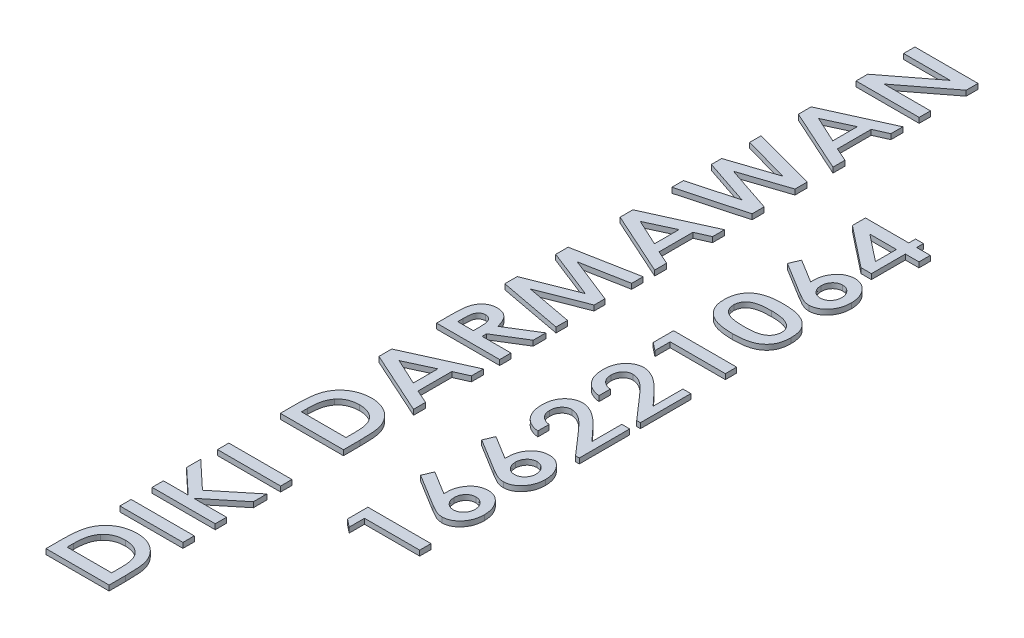
from build123d import *

# Parameters (mm, degrees)
BOSS_EXTRUDE1_DEPTH    = 0.5
BOSS_EXTRUDE1_2_DEPTH  = 0.5
BOSS_EXTRUDE1_3_DEPTH  = 0.5
BOSS_EXTRUDE1_4_DEPTH  = 0.5
BOSS_EXTRUDE1_5_DEPTH  = 0.5
BOSS_EXTRUDE1_6_DEPTH  = 0.5
BOSS_EXTRUDE1_7_DEPTH  = 0.5
BOSS_EXTRUDE1_8_DEPTH  = 0.5
SKETCH2_W              = 6.35
SKETCH2_H              = 1.383974359
BOSS_EXTRUDE1_9_DEPTH  = 0.5
BOSS_EXTRUDE1_10_DEPTH = 0.5
BOSS_EXTRUDE1_11_DEPTH = 0.5
BOSS_EXTRUDE1_12_DEPTH = 0.5
BOSS_EXTRUDE1_13_DEPTH = 0.5
BOSS_EXTRUDE1_14_DEPTH = 0.5
BOSS_EXTRUDE1_15_DEPTH = 0.5
BOSS_EXTRUDE1_16_DEPTH = 0.5
BOSS_EXTRUDE1_17_DEPTH = 0.5
BOSS_EXTRUDE1_18_DEPTH = 0.5
BOSS_EXTRUDE1_19_DEPTH = 0.5
BOSS_EXTRUDE1_20_DEPTH = 0.5
BOSS_EXTRUDE1_21_DEPTH = 0.5
SKETCH7_W              = 6.35
SKETCH7_H              = 1.383974359
SKETCH7_W_2            = 6.05
SKETCH7_H_2            = 1.083974359
CUT_EXTRUDE1_DEPTH     = 10
CUT_EXTRUDE2_DEPTH     = 10


with BuildPart() as part:
    # Sketch2 → Boss-Extrude1 (new body)
    with BuildSketch(Plane(origin=(0, 0, 0), x_dir=(1, 0, 0), z_dir=(0, 1, 0))):
        Polygon((-39.865832779, 41.979331063), (-39.865832779, 43.322600293), (-35.687196961, 46.538305422), (-39.865832779, 46.538305422), (-39.865832779, 47.922279781), (-33.515832779, 47.922279781), (-33.515832779, 46.567562233), (-37.681748243, 43.363305422), (-33.515832779, 43.363305422), (-33.515832779, 41.979331063), align=None)
    extrude(amount=BOSS_EXTRUDE1_DEPTH)


with BuildPart() as body_2:
    # Sketch2 → Boss-Extrude1 2 (new body)
    with BuildSketch(Plane(origin=(0, 0, 0), x_dir=(1, 0, 0), z_dir=(0, 1, 0))):
        Polygon((-39.865832779, 36.505763354), (-39.865832779, 37.925354701), (-33.515832779, 40.798882345), (-33.515832779, 39.319505342), (-34.818396881, 38.742001335), (-34.818396881, 35.692932826), (-33.515832779, 35.115428819), (-33.515832779, 33.634779781), align=None)
        Polygon((-38.16257757, 37.216831063), (-35.958140471, 36.196658787), (-35.958140471, 38.237003338), align=None, mode=Mode.SUBTRACT)
    extrude(amount=BOSS_EXTRUDE1_2_DEPTH)


with BuildPart() as body_3:
    # Sketch2 → Boss-Extrude1 3 (new body)
    with BuildSketch(Plane(origin=(0, 0, 0), x_dir=(1, 0, 0), z_dir=(0, 1, 0))):
        Polygon((-39.865832779, 24.272600293), (-39.865832779, 25.696007745), (-35.811856416, 26.796318242), (-39.865832779, 28.15103579), (-39.865832779, 29.354381143), (-35.811856416, 30.70401055), (-39.865832779, 31.801776976), (-39.865832779, 33.227728499), (-33.515832779, 31.506664797), (-33.515832779, 30.117602297), (-37.620690551, 28.750164396), (-33.515832779, 27.37891039), (-33.515832779, 25.997480101), align=None)
    extrude(amount=BOSS_EXTRUDE1_3_DEPTH)


with BuildPart() as body_4:
    # Sketch2 → Boss-Extrude1 4 (new body)
    with BuildSketch(Plane(origin=(0, 0, 0), x_dir=(1, 0, 0), z_dir=(0, 1, 0))):
        Polygon((-39.865832779, 19.409609508), (-39.865832779, 20.829200854), (-33.515832779, 23.702728499), (-33.515832779, 22.223351495), (-34.818396881, 21.645847489), (-34.818396881, 18.596778979), (-33.515832779, 18.019274973), (-33.515832779, 16.538625934), align=None)
        Polygon((-38.16257757, 20.120677217), (-35.958140471, 19.100504941), (-35.958140471, 21.140849492), align=None, mode=Mode.SUBTRACT)
    extrude(amount=BOSS_EXTRUDE1_4_DEPTH)


with BuildPart() as body_5:
    # Sketch2 → Boss-Extrude1 5 (new body)
    with BuildSketch(Plane(origin=(0, 0, 0), x_dir=(1, 0, 0), z_dir=(0, 1, 0))):
        Polygon((-39.865832779, 8.327638354), (-39.865832779, 9.751045806), (-35.436606016, 11.491190037), (-39.865832779, 13.235150374), (-39.865832779, 14.649653579), (-33.515832779, 15.846638755), (-33.515832779, 14.444855902), (-37.526559942, 13.68926696), (-33.515832779, 12.108127136), (-33.515832779, 10.867892761), (-37.526559942, 9.293113114), (-33.515832779, 8.540068242), (-33.515832779, 7.135741319), align=None)
    extrude(amount=BOSS_EXTRUDE1_5_DEPTH)


with BuildPart() as body_6:
    # Sketch2 → Boss-Extrude1 6 (new body)
    with BuildSketch(Plane(origin=(0, 0, 0), x_dir=(1, 0, 0), z_dir=(0, 1, 0))):
        with BuildLine():
            Line((-39.865832779, 1.762664396), (-39.865832779, 3.284018563))
            add(Edge.make_bspline(
                [(-39.865832779, 3.284018563), (-39.865524385, 3.384518856), (-39.864930884, 3.577930629), (-39.855419062, 3.856972233), (-39.842450943, 4.113678763), (-39.821777865, 4.347784325), (-39.797429399, 4.559310353), (-39.765278159, 4.748074916), (-39.729797681, 4.915041185), (-39.685456718, 5.061876814), (-39.635234322, 5.194091455), (-39.577083169, 5.316960552), (-39.513278236, 5.434481709), (-39.438267081, 5.543057447), (-39.359777257, 5.647757619), (-39.27140523, 5.744123465), (-39.175862521, 5.834806312), (-39.072838597, 5.918364176), (-38.964479436, 5.995178765), (-38.849004753, 6.059380143), (-38.730156084, 6.116484979), (-38.605805461, 6.162136408), (-38.476123126, 6.196113005), (-38.342745931, 6.221718544), (-38.204082703, 6.237462918), (-38.110041661, 6.239294506), (-38.062086785, 6.240228499)],
                knots=[0, 0, 0, 0, 1.836140719, 3.533633771, 5.10087734, 6.53173273, 7.827060477, 8.989882129, 10.029329562, 10.943526483, 11.789528399, 12.610909349, 13.425834763, 14.229450232, 15.019697848, 15.81494229, 16.615039843, 17.424496889, 18.236877441, 19.038286661, 19.835340363, 20.644166918, 21.454105773, 22.282181885, 23.124023373, 24, 24, 24, 24], degree=3))
            add(Edge.make_bspline(
                [(-38.062086785, 6.240228499), (-38.012006202, 6.239382622), (-37.913678481, 6.237721837), (-37.769405134, 6.220764729), (-37.631054211, 6.192850769), (-37.499170866, 6.153434318), (-37.373276663, 6.10382076), (-37.254243194, 6.042021916), (-37.14119895, 5.969895068), (-37.034724439, 5.885954224), (-36.93387043, 5.792229446), (-36.840961126, 5.68519457), (-36.753009252, 5.568124324), (-36.671292418, 5.439485914), (-36.59842034, 5.298654076), (-36.528836598, 5.14801579), (-36.466952762, 4.985490096), (-36.431584651, 4.87214175), (-36.413529093, 4.814276976)],
                knots=[0, 0, 0, 0, 1.016036467, 1.994875957, 2.943360592, 3.877249563, 4.784919431, 5.685545373, 6.595049126, 7.502270147, 8.433777149, 9.38499057, 10.374627171, 11.403591613, 12.473727256, 13.590459233, 14.769920025, 16, 16, 16, 16], degree=3))
            Line((-36.413529093, 4.814276976), (-33.515832779, 6.606574652))
            Line((-33.515832779, 6.606574652), (-33.515832779, 5.045787393))
            Line((-33.515832779, 5.045787393), (-36.283781496, 3.333627938))
            Line((-36.283781496, 3.333627938), (-36.283781496, 3.146638755))
            Line((-36.283781496, 3.146638755), (-33.515832779, 3.146638755))
            Line((-33.515832779, 3.146638755), (-33.515832779, 1.762664396))
            Line((-33.515832779, 1.762664396), (-39.865832779, 1.762664396))
        make_face()
        with BuildLine():
            Line((-37.423525086, 3.146638755), (-37.423525086, 3.612203659))
            add(Edge.make_bspline(
                [(-37.423525086, 3.612203659), (-37.424135527, 3.66902337), (-37.425306699, 3.77803575), (-37.430775678, 3.935111154), (-37.443750971, 4.078074023), (-37.460456692, 4.207436779), (-37.479147575, 4.323096989), (-37.50682956, 4.424306423), (-37.53619557, 4.512605049), (-37.572172494, 4.58781172), (-37.613911136, 4.651737835), (-37.66085072, 4.707147224), (-37.715377995, 4.753178818), (-37.775040407, 4.792383856), (-37.84293571, 4.81948114), (-37.915052935, 4.84164043), (-37.99421278, 4.854583334), (-38.048895487, 4.855682274), (-38.077351208, 4.85625414)],
                knots=[0, 0, 0, 0, 1.708363675, 3.277608857, 4.723712974, 6.021838054, 7.199660436, 8.241690857, 9.172961181, 9.993967569, 10.739999558, 11.46313589, 12.168296226, 12.87908003, 13.598837728, 14.357076655, 15.145057537, 16, 16, 16, 16], degree=3))
            add(Edge.make_bspline(
                [(-38.077351208, 4.85625414), (-38.111059329, 4.855151592), (-38.176970566, 4.852995723), (-38.271630177, 4.825128949), (-38.361052362, 4.785285165), (-38.440511123, 4.725285146), (-38.51262642, 4.653809599), (-38.573568361, 4.569343724), (-38.623254573, 4.473602306), (-38.656963048, 4.385468272), (-38.676640984, 4.304162158), (-38.690404239, 4.231171845), (-38.701845857, 4.146257545), (-38.709977931, 4.05027515), (-38.718092615, 3.942611621), (-38.722863497, 3.823400725), (-38.725084832, 3.692350729), (-38.725745205, 3.601180161), (-38.726089189, 3.553690037)],
                knots=[0, 0, 0, 0, 0.985108331, 1.926233394, 2.871946939, 3.841872085, 4.82658799, 5.841305238, 6.881378339, 7.9830261, 8.598222287, 9.332244696, 10.160477909, 11.109455359, 12.156565321, 13.326411148, 14.607345905, 16, 16, 16, 16], degree=3))
            Line((-38.726089189, 3.553690037), (-38.726089189, 3.146638755))
            Line((-38.726089189, 3.146638755), (-37.423525086, 3.146638755))
        make_face(mode=Mode.SUBTRACT)
    extrude(amount=BOSS_EXTRUDE1_6_DEPTH)


with BuildPart() as body_7:
    # Sketch2 → Boss-Extrude1 7 (new body)
    with BuildSketch(Plane(origin=(0, 0, 0), x_dir=(1, 0, 0), z_dir=(0, 1, 0))):
        Polygon((-39.865832779, -3.710903312), (-39.865832779, -2.291311966), (-33.515832779, 0.582215678), (-33.515832779, -0.897161325), (-34.818396881, -1.474665332), (-34.818396881, -4.523733841), (-33.515832779, -5.101237848), (-33.515832779, -6.581886886), align=None)
        Polygon((-38.16257757, -2.999835604), (-35.958140471, -4.02000788), (-35.958140471, -1.979663328), align=None, mode=Mode.SUBTRACT)
    extrude(amount=BOSS_EXTRUDE1_7_DEPTH)


with BuildPart() as body_8:
    # Sketch2 → Boss-Extrude1 8 (new body)
    with BuildSketch(Plane(origin=(0, 0, 0), x_dir=(1, 0, 0), z_dir=(0, 1, 0))):
        with BuildLine():
            Line((-39.865832779, -13.216822783), (-39.865832779, -11.526287928))
            add(Edge.make_bspline(
                [(-39.865832779, -11.526287928), (-39.865068626, -11.394397853), (-39.863591263, -11.139410139), (-39.846292656, -10.769948093), (-39.821008086, -10.426524632), (-39.782104901, -10.109721155), (-39.7368824, -9.818374464), (-39.676887435, -9.553888637), (-39.607796757, -9.31516594), (-39.526719016, -9.099805477), (-39.431903525, -8.902863272), (-39.326494365, -8.716129018), (-39.206287889, -8.539282683), (-39.073728533, -8.370522783), (-38.92696009, -8.211070215), (-38.765792695, -8.061215995), (-38.593204751, -7.918317822), (-38.407263971, -7.786415577), (-38.211636325, -7.665635154), (-38.005522497, -7.561075973), (-37.791777567, -7.471840871), (-37.569373721, -7.398921714), (-37.338654896, -7.343512491), (-37.100336411, -7.302629621), (-36.853758824, -7.277822672), (-36.686650228, -7.275203908), (-36.601790311, -7.273874066)],
                knots=[0, 0, 0, 0, 1.5523959, 3.001301528, 4.352999285, 5.604799306, 6.757683279, 7.822029648, 8.794919534, 9.681123577, 10.527248426, 11.365490068, 12.203018135, 13.041779708, 13.889551746, 14.75116885, 15.630529516, 16.525224616, 17.432610275, 18.334419173, 19.242820097, 20.156703043, 21.086422976, 22.033347148, 23.001308118, 24, 24, 24, 24], degree=3))
            add(Edge.make_bspline(
                [(-36.601790311, -7.273874066), (-36.541141585, -7.275069396), (-36.421411346, -7.277429169), (-36.243362611, -7.289662195), (-36.069510265, -7.313434136), (-35.898473895, -7.34298733), (-35.731726869, -7.384230258), (-35.568306057, -7.434057325), (-35.408389901, -7.492089833), (-35.20226015, -7.582089394), (-34.957729115, -7.712321404), (-34.686932717, -7.897543821), (-34.443311563, -8.111778087), (-34.228588977, -8.351727868), (-34.041940923, -8.609795489), (-33.884408621, -8.880110334), (-33.758856884, -9.161544811), (-33.679828804, -9.408612247), (-33.630394696, -9.62346691), (-33.601419011, -9.812390592), (-33.574911844, -10.027466343), (-33.551684034, -10.269601058), (-33.536035916, -10.539043582), (-33.525126104, -10.835503791), (-33.517034967, -11.159050426), (-33.516244413, -11.383814463), (-33.515832779, -11.500847223)],
                knots=[0, 0, 0, 0, 0.72867537, 1.438521159, 2.142347153, 2.835755973, 3.522642296, 4.204220005, 4.887451593, 5.564982256, 6.904909641, 8.208980868, 9.49747035, 10.792307207, 12.06895256, 13.317393139, 14.544146306, 15.763570442, 16.427113542, 17.190819835, 18.058265318, 19.030390145, 20.11227009, 21.299973169, 22.594118552, 24, 24, 24, 24], degree=3))
            Line((-33.515832779, -11.500847223), (-33.515832779, -13.216822783))
            Line((-33.515832779, -13.216822783), (-39.865832779, -13.216822783))
        make_face()
        with BuildLine():
            Line((-38.726089189, -11.832848424), (-34.655576368, -11.832848424))
            Line((-34.655576368, -11.832848424), (-34.655576368, -11.151037527))
            add(Edge.make_bspline(
                [(-34.655576368, -11.151037527), (-34.655931605, -11.070042106), (-34.656618139, -10.913509838), (-34.665591744, -10.687398278), (-34.68029903, -10.478595918), (-34.702239665, -10.287310298), (-34.727990385, -10.113050784), (-34.76103784, -9.955866194), (-34.799589414, -9.815680034), (-34.846349633, -9.691303976), (-34.899421462, -9.578077408), (-34.960846334, -9.472488574), (-35.030074737, -9.371270543), (-35.106726893, -9.274867252), (-35.193566559, -9.185592856), (-35.28623002, -9.099688443), (-35.388523217, -9.019611441), (-35.498468962, -8.945041513), (-35.615789267, -8.876929822), (-35.740389376, -8.819080791), (-35.87112965, -8.768771055), (-36.00861412, -8.728402192), (-36.152708709, -8.696723159), (-36.303483952, -8.67343445), (-36.460822455, -8.661409408), (-36.567852208, -8.659046836), (-36.622142875, -8.657848424)],
                knots=[0, 0, 0, 0, 1.593054988, 3.078748262, 4.45018865, 5.709219076, 6.86516435, 7.91367016, 8.866821376, 9.721920118, 10.52404956, 11.323703758, 12.121790688, 12.934559088, 13.742692869, 14.569082968, 15.418345626, 16.295053143, 17.180562888, 18.083458198, 18.994215758, 19.933658199, 20.898883592, 21.894404865, 22.931940332, 24, 24, 24, 24], degree=3))
            add(Edge.make_bspline(
                [(-36.622142875, -8.657848424), (-36.705379592, -8.659444755), (-36.867887677, -8.662561367), (-37.104160236, -8.697266941), (-37.326722302, -8.749391292), (-37.534734951, -8.825576883), (-37.72909188, -8.921382544), (-37.906862322, -9.042274395), (-38.073787145, -9.180115782), (-38.169092866, -9.289465326), (-38.217275086, -9.344747463)],
                knots=[0, 0, 0, 0, 1.110513663, 2.168123082, 3.181457114, 4.157496417, 5.119562644, 6.066350345, 7.022435032, 8, 8, 8, 8], degree=3))
            add(Edge.make_bspline(
                [(-38.217275086, -9.344747463), (-38.258651665, -9.399294552), (-38.343549608, -9.51121622), (-38.445327998, -9.704113689), (-38.533290807, -9.918294711), (-38.603680258, -10.156776727), (-38.659499465, -10.417849474), (-38.697700741, -10.702790901), (-38.722482053, -11.010672675), (-38.724859505, -11.223915527), (-38.726089189, -11.334210604)],
                knots=[0, 0, 0, 0, 0.784449229, 1.609560964, 2.493172684, 3.438229973, 4.458316484, 5.553695379, 6.734703866, 8, 8, 8, 8], degree=3))
            Line((-38.726089189, -11.334210604), (-38.726089189, -11.832848424))
        make_face(mode=Mode.SUBTRACT)
    extrude(amount=BOSS_EXTRUDE1_8_DEPTH)


with BuildPart() as body_9:
    # Sketch2 → Boss-Extrude1 9 (new body)
    with BuildSketch(Plane(origin=(0, 0, 0), x_dir=(1, 0, 0), z_dir=(0, 1, 0))):
        with Locations((-36.690832779, -18.549194578)):
            Rectangle(SKETCH2_W, SKETCH2_H)
    extrude(amount=BOSS_EXTRUDE1_9_DEPTH)


with BuildPart() as body_10:
    # Sketch2 → Boss-Extrude1 10 (new body)
    with BuildSketch(Plane(origin=(0, 0, 0), x_dir=(1, 0, 0), z_dir=(0, 1, 0))):
        Polygon((-39.865832779, -25.509771501), (-39.865832779, -24.125797142), (-37.724997442, -24.125797142), (-39.865832779, -22.117253473), (-39.865832779, -20.352940572), (-37.057178932, -22.987325588), (-33.515832779, -20.09598945), (-33.515832779, -21.776348024), (-36.394448564, -24.125797142), (-33.515832779, -24.125797142), (-33.515832779, -25.509771501), align=None)
    extrude(amount=BOSS_EXTRUDE1_10_DEPTH)


with BuildPart() as body_11:
    # Sketch2 → Boss-Extrude1 11 (new body)
    with BuildSketch(Plane(origin=(0, 0, 0), x_dir=(1, 0, 0), z_dir=(0, 1, 0))):
        with Locations((-36.690832779, -27.911374066)):
            Rectangle(SKETCH2_W, SKETCH2_H)
    extrude(amount=BOSS_EXTRUDE1_11_DEPTH)


with BuildPart() as body_12:
    # Sketch2 → Boss-Extrude1 12 (new body)
    with BuildSketch(Plane(origin=(0, 0, 0), x_dir=(1, 0, 0), z_dir=(0, 1, 0))):
        with BuildLine():
            Line((-39.865832779, -35.686053553), (-39.865832779, -33.995518697))
            add(Edge.make_bspline(
                [(-39.865832779, -33.995518697), (-39.865068626, -33.863628623), (-39.863591263, -33.608640908), (-39.846292656, -33.239178863), (-39.821008086, -32.895755401), (-39.782104901, -32.578951924), (-39.7368824, -32.287605233), (-39.676887435, -32.023119407), (-39.607796757, -31.784396709), (-39.526719016, -31.569036247), (-39.431903525, -31.372094041), (-39.326494365, -31.185359787), (-39.206287889, -31.008513453), (-39.073728533, -30.839753553), (-38.92696009, -30.680300984), (-38.765792695, -30.530446764), (-38.593204751, -30.387548591), (-38.407263971, -30.255646346), (-38.211636325, -30.134865923), (-38.005522497, -30.030306743), (-37.791777567, -29.941071641), (-37.569373721, -29.868152483), (-37.338654896, -29.812743261), (-37.100336411, -29.77186039), (-36.853758824, -29.747053441), (-36.686650228, -29.744434677), (-36.601790311, -29.743104835)],
                knots=[0, 0, 0, 0, 1.5523959, 3.001301528, 4.352999285, 5.604799306, 6.757683279, 7.822029648, 8.794919534, 9.681123577, 10.527248426, 11.365490068, 12.203018135, 13.041779708, 13.889551746, 14.75116885, 15.630529516, 16.525224616, 17.432610275, 18.334419173, 19.242820097, 20.156703043, 21.086422976, 22.033347148, 23.001308118, 24, 24, 24, 24], degree=3))
            add(Edge.make_bspline(
                [(-36.601790311, -29.743104835), (-36.541141585, -29.744300165), (-36.421411346, -29.746659938), (-36.243362611, -29.758892965), (-36.069510265, -29.782664905), (-35.898473895, -29.8122181), (-35.731726869, -29.853461027), (-35.568306057, -29.903288095), (-35.408389901, -29.961320602), (-35.20226015, -30.051320164), (-34.957729115, -30.181552173), (-34.686932717, -30.36677459), (-34.443311563, -30.581008856), (-34.228588977, -30.820958637), (-34.041940923, -31.079026258), (-33.884408621, -31.349341103), (-33.758856884, -31.63077558), (-33.679828804, -31.877843016), (-33.630394696, -32.092697679), (-33.601419011, -32.281621361), (-33.574911844, -32.496697112), (-33.551684034, -32.738831827), (-33.536035916, -33.008274352), (-33.525126104, -33.30473456), (-33.517034967, -33.628281196), (-33.516244413, -33.853045233), (-33.515832779, -33.970077992)],
                knots=[0, 0, 0, 0, 0.72867537, 1.438521159, 2.142347153, 2.835755973, 3.522642296, 4.204220005, 4.887451593, 5.564982256, 6.904909641, 8.208980868, 9.49747035, 10.792307207, 12.06895256, 13.317393139, 14.544146306, 15.763570442, 16.427113542, 17.190819835, 18.058265318, 19.030390145, 20.11227009, 21.299973169, 22.594118552, 24, 24, 24, 24], degree=3))
            Line((-33.515832779, -33.970077992), (-33.515832779, -35.686053553))
            Line((-33.515832779, -35.686053553), (-39.865832779, -35.686053553))
        make_face()
        with BuildLine():
            Line((-38.726089189, -34.302079194), (-34.655576368, -34.302079194))
            Line((-34.655576368, -34.302079194), (-34.655576368, -33.620268296))
            add(Edge.make_bspline(
                [(-34.655576368, -33.620268296), (-34.655931605, -33.539272876), (-34.656618139, -33.382740607), (-34.665591744, -33.156629048), (-34.68029903, -32.947826687), (-34.702239665, -32.756541068), (-34.727990385, -32.582281554), (-34.76103784, -32.425096963), (-34.799589414, -32.284910803), (-34.846349633, -32.160534745), (-34.899421462, -32.047308178), (-34.960846334, -31.941719343), (-35.030074737, -31.840501312), (-35.106726893, -31.744098022), (-35.193566559, -31.654823625), (-35.28623002, -31.568919212), (-35.388523217, -31.48884221), (-35.498468962, -31.414272283), (-35.615789267, -31.346160591), (-35.740389376, -31.28831156), (-35.87112965, -31.238001824), (-36.00861412, -31.197632962), (-36.152708709, -31.165953929), (-36.303483952, -31.142665219), (-36.460822455, -31.130640177), (-36.567852208, -31.128277605), (-36.622142875, -31.127079194)],
                knots=[0, 0, 0, 0, 1.593054988, 3.078748262, 4.45018865, 5.709219076, 6.86516435, 7.91367016, 8.866821376, 9.721920118, 10.52404956, 11.323703758, 12.121790688, 12.934559088, 13.742692869, 14.569082968, 15.418345626, 16.295053143, 17.180562888, 18.083458198, 18.994215758, 19.933658199, 20.898883592, 21.894404865, 22.931940332, 24, 24, 24, 24], degree=3))
            add(Edge.make_bspline(
                [(-36.622142875, -31.127079194), (-36.705379592, -31.128675524), (-36.867887677, -31.131792137), (-37.104160236, -31.16649771), (-37.326722302, -31.218622061), (-37.534734951, -31.294807652), (-37.72909188, -31.390613313), (-37.906862322, -31.511505165), (-38.073787145, -31.649346551), (-38.169092866, -31.758696096), (-38.217275086, -31.813978232)],
                knots=[0, 0, 0, 0, 1.110513663, 2.168123082, 3.181457114, 4.157496417, 5.119562644, 6.066350345, 7.022435032, 8, 8, 8, 8], degree=3))
            add(Edge.make_bspline(
                [(-38.217275086, -31.813978232), (-38.258651665, -31.868525322), (-38.343549608, -31.980446989), (-38.445327998, -32.173344458), (-38.533290807, -32.38752548), (-38.603680258, -32.626007496), (-38.659499465, -32.887080243), (-38.697700741, -33.17202167), (-38.722482053, -33.479903445), (-38.724859505, -33.693146296), (-38.726089189, -33.803441373)],
                knots=[0, 0, 0, 0, 0.784449229, 1.609560964, 2.493172684, 3.438229973, 4.458316484, 5.553695379, 6.734703866, 8, 8, 8, 8], degree=3))
            Line((-38.726089189, -33.803441373), (-38.726089189, -34.302079194))
        make_face(mode=Mode.SUBTRACT)
    extrude(amount=BOSS_EXTRUDE1_12_DEPTH)


with BuildPart() as body_13:
    # Sketch2 → Boss-Extrude1 13 (new body)
    with BuildSketch(Plane(origin=(0, 0, 0), x_dir=(1, 0, 0), z_dir=(0, 1, 0))):
        Polygon((-28.038268676, 29.881003739), (-28.038268676, 31.355292601), (-23.886345599, 31.355292601), (-23.886345599, 32.006574652), (-22.828012266, 32.006574652), (-22.828012266, 31.355292601), (-21.525448163, 31.355292601), (-21.525448163, 29.971318242), (-22.828012266, 29.971318242), (-22.828012266, 26.714907986), (-24.026269477, 26.714907986), align=None)
        Polygon((-23.886345599, 29.971318242), (-26.0475335, 29.971318242), (-23.886345599, 28.266790999), align=None, mode=Mode.SUBTRACT)
    extrude(amount=BOSS_EXTRUDE1_13_DEPTH)


with BuildPart() as body_14:
    # Sketch2 → Boss-Extrude1 14 (new body)
    with BuildSketch(Plane(origin=(0, 0, 0), x_dir=(1, 0, 0), z_dir=(0, 1, 0))):
        with BuildLine():
            Line((-28.038268676, 23.622590277), (-27.515462186, 24.861552617))
            Line((-27.515462186, 24.861552617), (-25.351730214, 23.533547809))
            add(Edge.make_bspline(
                [(-25.351730214, 23.533547809), (-25.350077024, 23.611643549), (-25.346832456, 23.764915047), (-25.319527338, 23.99055951), (-25.274142081, 24.206877316), (-25.209457177, 24.414169079), (-25.130309463, 24.613498531), (-25.029677862, 24.80309896), (-24.91137451, 24.983371766), (-24.776982201, 25.153340206), (-24.629641103, 25.308792252), (-24.471809969, 25.445540103), (-24.304861421, 25.561558919), (-24.129034244, 25.655905507), (-23.943749173, 25.729316373), (-23.749909015, 25.780806258), (-23.547438544, 25.814188639), (-23.409465956, 25.817641152), (-23.339370439, 25.819395165)],
                knots=[0, 0, 0, 0, 1.104852299, 2.168394447, 3.211064878, 4.228357633, 5.237852068, 6.241677703, 7.260190732, 8.285380527, 9.303981925, 10.28673003, 11.235459418, 12.175036862, 13.104307491, 14.048948534, 15.008788892, 16, 16, 16, 16], degree=3))
            add(Edge.make_bspline(
                [(-23.339370439, 25.819395165), (-23.271804789, 25.817706782), (-23.137955931, 25.814362062), (-22.941806451, 25.779614283), (-22.752989675, 25.726471114), (-22.572615851, 25.651040869), (-22.400777407, 25.552762089), (-22.236135931, 25.434340581), (-22.080428181, 25.29282509), (-21.934306507, 25.132391991), (-21.801126359, 24.957171634), (-21.682324564, 24.772100146), (-21.585077732, 24.576066285), (-21.502725001, 24.372750914), (-21.440781982, 24.15943763), (-21.394670637, 23.938422964), (-21.367574411, 23.707643503), (-21.364297007, 23.551003306), (-21.36262765, 23.471218082)],
                knots=[0, 0, 0, 0, 0.950200861, 1.882366258, 2.79485287, 3.707124736, 4.62659236, 5.575761667, 6.556204861, 7.58281384, 8.626150887, 9.651092898, 10.673407406, 11.70194045, 12.734983526, 13.795507081, 14.877133927, 16, 16, 16, 16], degree=3))
            add(Edge.make_bspline(
                [(-21.36262765, 23.471218082), (-21.364023564, 23.388013902), (-21.366760475, 23.224878912), (-21.397547871, 22.985864816), (-21.444247625, 22.757367201), (-21.508726349, 22.538415515), (-21.594229187, 22.330519959), (-21.699544255, 22.133852878), (-21.821574992, 21.946976223), (-21.962629696, 21.774297451), (-22.114541988, 21.616786629), (-22.274345586, 21.478601494), (-22.438802053, 21.360138612), (-22.609967491, 21.264215803), (-22.786790962, 21.189999603), (-22.968739854, 21.135924723), (-23.156700916, 21.103107462), (-23.284119619, 21.099444558), (-23.348274686, 21.097600293)],
                knots=[0, 0, 0, 0, 1.163605067, 2.28143228, 3.365885876, 4.424585855, 5.470171178, 6.505301569, 7.541995037, 8.58811887, 9.620286534, 10.600377861, 11.540431962, 12.451506364, 13.339631748, 14.218193408, 15.102863888, 16, 16, 16, 16], degree=3))
            add(Edge.make_bspline(
                [(-23.348274686, 21.097600293), (-23.397933885, 21.098874183), (-23.497613079, 21.101431218), (-23.647207148, 21.120734957), (-23.796377916, 21.155224039), (-23.923162685, 21.191172391), (-24.028961261, 21.232310898), (-24.11952717, 21.270431829), (-24.2197284, 21.317425265), (-24.329246832, 21.374459506), (-24.450194818, 21.437509567), (-24.58090709, 21.509898194), (-24.720940166, 21.592186045), (-24.817902557, 21.649235034), (-24.868356817, 21.678920406)],
                knots=[0, 0, 0, 0, 1.083710445, 2.175294508, 3.284428465, 4.423427011, 5.047302797, 5.760584302, 6.567863041, 7.461823998, 8.455286899, 9.544672085, 10.722373158, 12, 12, 12, 12], degree=3))
            Line((-24.868356817, 21.678920406), (-28.038268676, 23.622590277))
        make_face()
        with BuildLine():
            add(Edge.make_bspline(
                [(-24.293396881, 23.440689236), (-24.290965079, 23.375036094), (-24.286249482, 23.24772566), (-24.235100945, 23.06587687), (-24.155823281, 22.900054212), (-24.063071355, 22.777641334), (-23.975934187, 22.692767685), (-23.906880713, 22.635358665), (-23.832339974, 22.588816556), (-23.755073334, 22.548385547), (-23.672519956, 22.519638238), (-23.586582466, 22.497931211), (-23.496764712, 22.483081103), (-23.435256241, 22.482079601), (-23.404244237, 22.481574652)],
                knots=[0, 0, 0, 0, 1.615041626, 3.13178689, 4.618834842, 6.126543818, 6.888081144, 7.616378775, 8.335689859, 9.051115013, 9.762171936, 10.484894433, 11.236097757, 12, 12, 12, 12], degree=3))
            add(Edge.make_bspline(
                [(-23.404244237, 22.481574652), (-23.372830123, 22.482727478), (-23.311442018, 22.484980279), (-23.220870127, 22.497573357), (-23.134678658, 22.520432225), (-23.052188343, 22.552986991), (-22.973266753, 22.593167941), (-22.89890617, 22.644063533), (-22.827448023, 22.702031536), (-22.740155918, 22.792410933), (-22.64499745, 22.916357185), (-22.562098863, 23.081991855), (-22.5116166, 23.260094503), (-22.505491089, 23.383118637), (-22.50237124, 23.445777377)],
                knots=[0, 0, 0, 0, 0.771750927, 1.508122302, 2.240654537, 2.956186265, 3.682772524, 4.410626367, 5.165326201, 5.938551208, 7.492312259, 8.982623137, 10.463187472, 12, 12, 12, 12], degree=3))
            add(Edge.make_bspline(
                [(-22.50237124, 23.445777377), (-22.505618713, 23.511350227), (-22.511969961, 23.639594407), (-22.559860271, 23.824840001), (-22.641928222, 23.994416717), (-22.735272929, 24.121249101), (-22.82243737, 24.211718865), (-22.89226143, 24.272750159), (-22.968286107, 24.321318375), (-23.046222984, 24.365387008), (-23.130327876, 24.395816509), (-23.21779267, 24.419871518), (-23.309787747, 24.431858683), (-23.372417553, 24.434220565), (-23.404244237, 24.435420806)],
                knots=[0, 0, 0, 0, 1.581677803, 3.09336824, 4.58103324, 6.103975483, 6.871201912, 7.611611879, 8.335426315, 9.045213142, 9.767506578, 10.487403377, 11.231341477, 12, 12, 12, 12], degree=3))
            add(Edge.make_bspline(
                [(-23.404244237, 24.435420806), (-23.435263839, 24.434935954), (-23.49678738, 24.433974308), (-23.586494952, 24.41883279), (-23.673122409, 24.398113949), (-23.754471099, 24.365325293), (-23.832730508, 24.325945278), (-23.907315761, 24.277752163), (-23.975500729, 24.217745093), (-24.063933141, 24.131027846), (-24.155719775, 24.003811529), (-24.235955474, 23.832139645), (-24.286082784, 23.642353425), (-24.290909472, 23.509272043), (-24.293396881, 23.440689236)],
                knots=[0, 0, 0, 0, 0.748385906, 1.484330833, 2.192373433, 2.896180001, 3.597073481, 4.307335424, 5.033954227, 5.787231139, 7.297193698, 8.791018416, 10.34626781, 12, 12, 12, 12], degree=3))
        make_face(mode=Mode.SUBTRACT)
    extrude(amount=BOSS_EXTRUDE1_14_DEPTH)


with BuildPart() as body_15:
    # Sketch2 → Boss-Extrude1 15 (new body)
    with BuildSketch(Plane(origin=(0, 0, 0), x_dir=(1, 0, 0), z_dir=(0, 1, 0))):
        with BuildLine():
            add(Edge.make_bspline(
                [(-28.038268676, 17.65547289), (-28.037446416, 17.722080657), (-28.035830651, 17.852966788), (-28.018482795, 18.045761806), (-27.991917488, 18.231770948), (-27.955856645, 18.410981276), (-27.906759374, 18.582418974), (-27.848235404, 18.746895139), (-27.779885312, 18.905048177), (-27.69955446, 19.055717089), (-27.607383422, 19.198093343), (-27.50604869, 19.334261971), (-27.390331667, 19.459511275), (-27.266328204, 19.578917776), (-27.128286922, 19.686807624), (-26.981367394, 19.788694), (-26.822545908, 19.882187726), (-26.651154734, 19.966195826), (-26.465731193, 20.041968945), (-26.263448763, 20.106126753), (-26.044952816, 20.162548564), (-25.808416815, 20.205766745), (-25.555212631, 20.242214697), (-25.284204372, 20.264765474), (-24.996604351, 20.280930765), (-24.79926816, 20.282626629), (-24.697904093, 20.283497729)],
                knots=[0, 0, 0, 0, 0.986826532, 1.939141818, 2.865971136, 3.770486801, 4.645674334, 5.506235902, 6.356063545, 7.196571521, 8.033195155, 8.867645124, 9.708340974, 10.557262185, 11.415917643, 12.301331143, 13.205475706, 14.144051843, 15.127692503, 16.170920553, 17.286481654, 18.46954603, 19.732275457, 21.075970943, 22.498037898, 24, 24, 24, 24], degree=3))
            add(Edge.make_bspline(
                [(-24.697904093, 20.283497729), (-24.595273526, 20.282577872), (-24.39582909, 20.28079029), (-24.105571219, 20.265373515), (-23.832666969, 20.240246627), (-23.577436439, 20.2052268), (-23.33960915, 20.159462341), (-23.119401933, 20.103985522), (-22.916431886, 20.038253072), (-22.730488035, 19.961339304), (-22.559721475, 19.875076611), (-22.399875909, 19.784408868), (-22.253410664, 19.683901815), (-22.116433338, 19.579342559), (-21.993182199, 19.465162069), (-21.880007222, 19.345918375), (-21.781242976, 19.217423176), (-21.690692054, 19.083645401), (-21.613856781, 18.940309849), (-21.545061395, 18.789551106), (-21.490661111, 18.628769104), (-21.442100477, 18.460238605), (-21.407986162, 18.281666552), (-21.380457029, 18.094621758), (-21.365532759, 17.898251536), (-21.363609396, 17.764466278), (-21.36262765, 17.696178018)],
                knots=[0, 0, 0, 0, 1.53004645, 2.973375868, 4.332102595, 5.615022274, 6.812669083, 7.941130964, 8.998660699, 9.990675271, 10.937761969, 11.849679441, 12.72811483, 13.584178203, 14.416381081, 15.230376939, 16.032104778, 16.829859994, 17.636086303, 18.453829307, 19.297525861, 20.164144427, 21.066701424, 22.005417442, 22.981901487, 24, 24, 24, 24], degree=3))
            add(Edge.make_bspline(
                [(-21.36262765, 17.696178018), (-21.363616685, 17.627889535), (-21.36556045, 17.493681093), (-21.380483758, 17.296474314), (-21.407902037, 17.10812631), (-21.442565356, 16.927598847), (-21.490297019, 16.755724354), (-21.546678892, 16.591082414), (-21.616170092, 16.436077685), (-21.693595677, 16.288288082), (-21.783185906, 16.149580251), (-21.882706111, 16.018229358), (-21.992032681, 15.894044337), (-22.114233211, 15.779320767), (-22.246432866, 15.671411957), (-22.389093127, 15.570102867), (-22.544105222, 15.479402695), (-22.708765342, 15.392930474), (-22.888416617, 15.315267391), (-23.0862223, 15.252249627), (-23.300687108, 15.195051116), (-23.533967393, 15.152208701), (-23.784689158, 15.116192086), (-24.053425413, 15.091430431), (-24.339853356, 15.075925805), (-24.536758351, 15.074153594), (-24.638118436, 15.073241319)],
                knots=[0, 0, 0, 0, 1.023221228, 2.010952973, 2.960682302, 3.874011571, 4.763358527, 5.631389659, 6.47904572, 7.306117631, 8.129153172, 8.950027866, 9.773651744, 10.605080346, 11.45845546, 12.329249144, 13.223823138, 14.147371026, 15.115099819, 16.151822583, 17.255203172, 18.438958645, 19.703167639, 21.049754519, 22.481312608, 24, 24, 24, 24], degree=3))
            add(Edge.make_bspline(
                [(-24.638118436, 15.073241319), (-24.778940197, 15.075177094), (-25.050729566, 15.078913184), (-25.443689034, 15.107904167), (-25.806527912, 15.157019947), (-26.139871724, 15.224418617), (-26.442925472, 15.313469705), (-26.716567393, 15.420889655), (-26.961527609, 15.548277413), (-27.104899284, 15.653195914), (-27.174556737, 15.704170806)],
                knots=[0, 0, 0, 0, 1.270554087, 2.452199792, 3.552731428, 4.572428878, 5.517880761, 6.398834259, 7.222069991, 8, 8, 8, 8], degree=3))
            add(Edge.make_bspline(
                [(-27.174556737, 15.704170806), (-27.243513535, 15.764073767), (-27.379694321, 15.882374392), (-27.555485726, 16.085830873), (-27.706451402, 16.304339612), (-27.827234699, 16.542346642), (-27.923416801, 16.79631174), (-27.990412259, 17.067894102), (-28.030112074, 17.356215206), (-28.03550308, 17.554005909), (-28.038268676, 17.65547289)],
                knots=[0, 0, 0, 0, 0.990681992, 1.956469204, 2.910354335, 3.867787993, 4.846848932, 5.852890592, 6.898529083, 8, 8, 8, 8], degree=3))
        make_face()
        with BuildLine():
            add(Edge.make_bspline(
                [(-26.898525086, 17.688545806), (-26.896053154, 17.62942005), (-26.891183988, 17.51295521), (-26.853491329, 17.343715467), (-26.79114411, 17.184968903), (-26.720876338, 17.060966388), (-26.649721635, 16.969393122), (-26.587363851, 16.904210504), (-26.514800247, 16.84453965), (-26.435096118, 16.786996942), (-26.34556667, 16.734785044), (-26.246945909, 16.688678519), (-26.141134856, 16.643038569), (-26.024539951, 16.603796369), (-25.896495026, 16.569869073), (-25.75573718, 16.538783357), (-25.600985526, 16.514471837), (-25.432671029, 16.49238635), (-25.250606996, 16.476278334), (-25.054624463, 16.464933128), (-24.844649695, 16.458920755), (-24.700027535, 16.457796057), (-24.625398083, 16.457215678)],
                knots=[0, 0, 0, 0, 1.214587884, 2.392473148, 3.543218464, 4.71073995, 5.306973042, 5.923376398, 6.560563542, 7.235326945, 7.942358987, 8.686911065, 9.471985168, 10.309854188, 11.212615155, 12.193875539, 13.271361611, 14.431311457, 15.682769858, 17.027249578, 18.465969985, 20, 20, 20, 20], degree=3))
            add(Edge.make_bspline(
                [(-24.625398083, 16.457215678), (-24.528696172, 16.457980829), (-24.343193194, 16.459448615), (-24.076638209, 16.476352044), (-23.833339372, 16.502542024), (-23.612913984, 16.538219382), (-23.416051775, 16.586591947), (-23.241757969, 16.64421382), (-23.090560537, 16.713456015), (-22.962282608, 16.795188467), (-22.853514394, 16.88508769), (-22.759680151, 16.981098646), (-22.680219934, 17.083468808), (-22.614447647, 17.191989638), (-22.564987456, 17.307411167), (-22.528844799, 17.428553661), (-22.506856222, 17.556307279), (-22.503884151, 17.643938014), (-22.50237124, 17.688545806)],
                knots=[0, 0, 0, 0, 1.679342007, 3.221476598, 4.636553652, 5.928371343, 7.096505702, 8.153804033, 9.112563178, 9.976743654, 10.787664292, 11.558432598, 12.303803208, 13.03380825, 13.7561581, 14.478470409, 15.225476363, 16, 16, 16, 16], degree=3))
            add(Edge.make_bspline(
                [(-22.50237124, 17.688545806), (-22.503423336, 17.731458298), (-22.505477738, 17.815252422), (-22.526539082, 17.937446369), (-22.56081223, 18.052922827), (-22.6094982, 18.161341871), (-22.671205913, 18.263246299), (-22.747194637, 18.357766125), (-22.836166154, 18.44609284), (-22.904107892, 18.497064527), (-22.938679333, 18.523000934)],
                knots=[0, 0, 0, 0, 1.048278946, 2.046947455, 3.02099404, 3.986174388, 4.94442698, 5.925508864, 6.944416953, 8, 8, 8, 8], degree=3))
            add(Edge.make_bspline(
                [(-22.938679333, 18.523000934), (-22.985554116, 18.553314949), (-23.083275707, 18.616511695), (-23.248874076, 18.693900457), (-23.437326247, 18.755736593), (-23.646582751, 18.810021365), (-23.878695753, 18.848726445), (-24.131936921, 18.880292597), (-24.407700768, 18.895339128), (-24.598673546, 18.898092633), (-24.697904093, 18.89952337)],
                knots=[0, 0, 0, 0, 0.73363436, 1.529434623, 2.395365967, 3.339496309, 4.370063941, 5.48791158, 6.694704504, 8, 8, 8, 8], degree=3))
            add(Edge.make_bspline(
                [(-24.697904093, 18.89952337), (-24.798001596, 18.898790559), (-24.990713003, 18.897379723), (-25.267328388, 18.879949575), (-25.520136404, 18.855941322), (-25.748454854, 18.819579397), (-25.952591472, 18.771618719), (-26.132971567, 18.713754314), (-26.289570152, 18.645645197), (-26.42294343, 18.56628286), (-26.533970557, 18.476199276), (-26.632658119, 18.383859992), (-26.713712645, 18.282348685), (-26.782484673, 18.176424857), (-26.835018927, 18.063367392), (-26.872080132, 17.944032161), (-26.894012164, 17.818250852), (-26.897002524, 17.73230548), (-26.898525086, 17.688545806)],
                knots=[0, 0, 0, 0, 1.705083879, 3.282690406, 4.720299792, 6.030237024, 7.218210755, 8.289614354, 9.253402044, 10.121863153, 10.924008211, 11.685264082, 12.4197249, 13.131122611, 13.832435875, 14.536163306, 15.254677544, 16, 16, 16, 16], degree=3))
        make_face(mode=Mode.SUBTRACT)
    extrude(amount=BOSS_EXTRUDE1_15_DEPTH)


with BuildPart() as body_16:
    # Sketch2 → Boss-Extrude1 16 (new body)
    with BuildSketch(Plane(origin=(0, 0, 0), x_dir=(1, 0, 0), z_dir=(0, 1, 0))):
        Polygon((-27.875448163, 10.621117922), (-27.875448163, 12.79375414), (-21.525448163, 12.79375414), (-21.525448163, 11.409779781), (-26.81711483, 11.409779781), (-26.81711483, 9.781574652), align=None)
    extrude(amount=BOSS_EXTRUDE1_16_DEPTH)


with BuildPart() as body_17:
    # Sketch2 → Boss-Extrude1 17 (new body)
    with BuildSketch(Plane(origin=(0, 0, 0), x_dir=(1, 0, 0), z_dir=(0, 1, 0))):
        with BuildLine():
            Line((-25.758781496, 4.896959268), (-25.758781496, 3.512984909))
            add(Edge.make_bspline(
                [(-25.758781496, 3.512984909), (-25.845035444, 3.519535454), (-26.0137782, 3.532350601), (-26.25881787, 3.576605632), (-26.490857612, 3.637610222), (-26.707267423, 3.723092559), (-26.911769504, 3.823726419), (-27.099312195, 3.949297916), (-27.2745026, 4.091467857), (-27.433391189, 4.253697559), (-27.575691331, 4.431447046), (-27.699278563, 4.623020355), (-27.80455576, 4.826482431), (-27.88909641, 5.042521416), (-27.95779295, 5.26981579), (-28.003157376, 5.509939896), (-28.034231439, 5.761552158), (-28.036903641, 5.933567998), (-28.038268676, 6.021438434)],
                knots=[0, 0, 0, 0, 1.094911714, 2.14202856, 3.149020222, 4.128339032, 5.08418636, 6.029979122, 6.980258772, 7.937206708, 8.900013288, 9.859293944, 10.820016542, 11.796297507, 12.793663542, 13.822624809, 14.887736687, 16, 16, 16, 16], degree=3))
            add(Edge.make_bspline(
                [(-28.038268676, 6.021438434), (-28.035681069, 6.129336979), (-28.030642464, 6.339437759), (-27.981545006, 6.644199373), (-27.90649712, 6.930386678), (-27.798091298, 7.19586272), (-27.6600021, 7.438840316), (-27.495486594, 7.658279078), (-27.302272883, 7.851356135), (-27.084835124, 8.014693726), (-26.853577066, 8.147447513), (-26.615971449, 8.244438004), (-26.37575836, 8.304912897), (-26.214078152, 8.31245568), (-26.134031897, 8.316190037)],
                knots=[0, 0, 0, 0, 1.171962649, 2.282053653, 3.34638693, 4.381992327, 5.389263176, 6.376490328, 7.354182589, 8.347865147, 9.324263826, 10.244310975, 11.130775921, 12, 12, 12, 12], degree=3))
            add(Edge.make_bspline(
                [(-26.134031897, 8.316190037), (-26.08565623, 8.314731728), (-25.988216902, 8.31179437), (-25.84052169, 8.295053392), (-25.69060555, 8.265302242), (-25.537664321, 8.224422663), (-25.382225962, 8.172015828), (-25.224041694, 8.107802735), (-25.062932529, 8.033066914), (-24.89835958, 7.945602146), (-24.728416983, 7.842729061), (-24.552737196, 7.720474956), (-24.369027053, 7.579404804), (-24.176778754, 7.420860105), (-23.978823733, 7.240612909), (-23.773248416, 7.041961456), (-23.558562466, 6.825665938), (-23.416483946, 6.671906023), (-23.343186545, 6.592582265)],
                knots=[0, 0, 0, 0, 0.688694447, 1.387183428, 2.11276027, 2.86231426, 3.63909801, 4.446034928, 5.291203246, 6.165979058, 7.097541031, 8.117091126, 9.210744093, 10.393831962, 11.662941326, 13.020297505, 14.462790515, 16, 16, 16, 16], degree=3))
            Line((-23.343186545, 6.592582265), (-22.583781496, 5.772119524))
            Line((-22.583781496, 5.772119524), (-22.583781496, 8.397600293))
            Line((-22.583781496, 8.397600293), (-21.525448163, 8.397600293))
            Line((-21.525448163, 8.397600293), (-21.525448163, 3.26875414))
            Line((-21.525448163, 3.26875414), (-22.10295217, 3.26875414))
            Line((-22.10295217, 3.26875414), (-24.103863628, 5.555873531))
            add(Edge.make_bspline(
                [(-24.103863628, 5.555873531), (-24.162062579, 5.62230269), (-24.27424618, 5.750350741), (-24.441499561, 5.930902593), (-24.598523355, 6.095780131), (-24.748582723, 6.241381864), (-24.88873835, 6.371127066), (-25.020453338, 6.482545618), (-25.142934295, 6.578119277), (-25.291642379, 6.678472184), (-25.466599541, 6.778663804), (-25.67103321, 6.865092319), (-25.865098952, 6.922027176), (-25.992921453, 6.928925249), (-26.053893676, 6.932215678)],
                knots=[0, 0, 0, 0, 1.296847865, 2.499788417, 3.613915099, 4.639853241, 5.56968939, 6.417957702, 7.172675718, 7.849648746, 9.051363979, 10.125684013, 11.10593823, 12, 12, 12, 12], degree=3))
            add(Edge.make_bspline(
                [(-26.053893676, 6.932215678), (-26.083636492, 6.931711169), (-26.14262108, 6.930710651), (-26.228636251, 6.915861712), (-26.310790451, 6.894170108), (-26.389496517, 6.865274786), (-26.46340194, 6.825114995), (-26.533338257, 6.776895383), (-26.598964971, 6.719711678), (-26.681566089, 6.63416312), (-26.769441798, 6.509306818), (-26.845351094, 6.338361495), (-26.8902588, 6.147100558), (-26.895704311, 6.013203154), (-26.898525086, 5.943844284)],
                knots=[0, 0, 0, 0, 0.735439748, 1.458490348, 2.153571291, 2.837868939, 3.528178103, 4.229885023, 4.936910351, 5.679283792, 7.170398876, 8.688063001, 10.284416287, 12, 12, 12, 12], degree=3))
            add(Edge.make_bspline(
                [(-26.898525086, 5.943844284), (-26.897462362, 5.907763987), (-26.895378759, 5.837024048), (-26.881529194, 5.733325113), (-26.856811767, 5.634663983), (-26.823833647, 5.539834398), (-26.78096056, 5.449405444), (-26.726338654, 5.364909309), (-26.663655679, 5.284589437), (-26.593216589, 5.208011121), (-26.512596479, 5.140014026), (-26.425984693, 5.07801666), (-26.331390691, 5.026206418), (-26.230135508, 4.982380027), (-26.121598417, 4.948727548), (-26.006932086, 4.921743), (-25.885227463, 4.903674014), (-25.801666667, 4.899236628), (-25.758781496, 4.896959268)],
                knots=[0, 0, 0, 0, 1.001765848, 1.964087337, 2.8977549, 3.821123521, 4.747863068, 5.668827078, 6.608413354, 7.574615477, 8.551445322, 9.531320797, 10.527259149, 11.539758509, 12.58968705, 13.677668045, 14.808130021, 16, 16, 16, 16], degree=3))
        make_face()
    extrude(amount=BOSS_EXTRUDE1_17_DEPTH)


with BuildPart() as body_18:
    # Sketch2 → Boss-Extrude1 18 (new body)
    with BuildSketch(Plane(origin=(0, 0, 0), x_dir=(1, 0, 0), z_dir=(0, 1, 0))):
        with BuildLine():
            Line((-25.758781496, -0.964579194), (-25.758781496, -2.348553553))
            add(Edge.make_bspline(
                [(-25.758781496, -2.348553553), (-25.845035444, -2.342003008), (-26.0137782, -2.32918786), (-26.25881787, -2.28493283), (-26.490857612, -2.22392824), (-26.707267423, -2.138445903), (-26.911769504, -2.037812042), (-27.099312195, -1.912240545), (-27.2745026, -1.770070605), (-27.433391189, -1.607840903), (-27.575691331, -1.430091416), (-27.699278563, -1.238518106), (-27.80455576, -1.03505603), (-27.88909641, -0.819017046), (-27.95779295, -0.591722671), (-28.003157376, -0.351598566), (-28.034231439, -0.099986304), (-28.036903641, 0.072029536), (-28.038268676, 0.159899973)],
                knots=[0, 0, 0, 0, 1.094911714, 2.14202856, 3.149020222, 4.128339032, 5.08418636, 6.029979122, 6.980258772, 7.937206708, 8.900013288, 9.859293944, 10.820016542, 11.796297507, 12.793663542, 13.822624809, 14.887736687, 16, 16, 16, 16], degree=3))
            add(Edge.make_bspline(
                [(-28.038268676, 0.159899973), (-28.035681069, 0.267798517), (-28.030642464, 0.477899298), (-27.981545006, 0.782660911), (-27.90649712, 1.068848216), (-27.798091298, 1.334324258), (-27.6600021, 1.577301854), (-27.495486594, 1.796740617), (-27.302272883, 1.989817673), (-27.084835124, 2.153155264), (-26.853577066, 2.285909052), (-26.615971449, 2.382899542), (-26.37575836, 2.443374435), (-26.214078152, 2.450917219), (-26.134031897, 2.454651576)],
                knots=[0, 0, 0, 0, 1.171962649, 2.282053653, 3.34638693, 4.381992327, 5.389263176, 6.376490328, 7.354182589, 8.347865147, 9.324263826, 10.244310975, 11.130775921, 12, 12, 12, 12], degree=3))
            add(Edge.make_bspline(
                [(-26.134031897, 2.454651576), (-26.08565623, 2.453193266), (-25.988216902, 2.450255908), (-25.84052169, 2.43351493), (-25.69060555, 2.403763781), (-25.537664321, 2.362884202), (-25.382225962, 2.310477367), (-25.224041694, 2.246264274), (-25.062932529, 2.171528452), (-24.89835958, 2.084063684), (-24.728416983, 1.9811906), (-24.552737196, 1.858936494), (-24.369027053, 1.717866343), (-24.176778754, 1.559321643), (-23.978823733, 1.379074448), (-23.773248416, 1.180422994), (-23.558562466, 0.964127476), (-23.416483946, 0.810367561), (-23.343186545, 0.731043803)],
                knots=[0, 0, 0, 0, 0.688694447, 1.387183428, 2.11276027, 2.86231426, 3.63909801, 4.446034928, 5.291203246, 6.165979058, 7.097541031, 8.117091126, 9.210744093, 10.393831962, 11.662941326, 13.020297505, 14.462790515, 16, 16, 16, 16], degree=3))
            Line((-23.343186545, 0.731043803), (-22.583781496, -0.089418937))
            Line((-22.583781496, -0.089418937), (-22.583781496, 2.536061832))
            Line((-22.583781496, 2.536061832), (-21.525448163, 2.536061832))
            Line((-21.525448163, 2.536061832), (-21.525448163, -2.592784322))
            Line((-21.525448163, -2.592784322), (-22.10295217, -2.592784322))
            Line((-22.10295217, -2.592784322), (-24.103863628, -0.305664931))
            add(Edge.make_bspline(
                [(-24.103863628, -0.305664931), (-24.162062579, -0.239235772), (-24.27424618, -0.111187721), (-24.441499561, 0.069364132), (-24.598523355, 0.23424167), (-24.748582723, 0.379843402), (-24.88873835, 0.509588604), (-25.020453338, 0.621007157), (-25.142934295, 0.716580815), (-25.291642379, 0.816933722), (-25.466599541, 0.917125343), (-25.67103321, 1.003553857), (-25.865098952, 1.060488714), (-25.992921453, 1.067386788), (-26.053893676, 1.070677217)],
                knots=[0, 0, 0, 0, 1.296847865, 2.499788417, 3.613915099, 4.639853241, 5.56968939, 6.417957702, 7.172675718, 7.849648746, 9.051363979, 10.125684013, 11.10593823, 12, 12, 12, 12], degree=3))
            add(Edge.make_bspline(
                [(-26.053893676, 1.070677217), (-26.083636492, 1.070172708), (-26.14262108, 1.069172189), (-26.228636251, 1.054323251), (-26.310790451, 1.032631646), (-26.389496517, 1.003736324), (-26.46340194, 0.963576533), (-26.533338257, 0.915356921), (-26.598964971, 0.858173216), (-26.681566089, 0.772624658), (-26.769441798, 0.647768356), (-26.845351094, 0.476823033), (-26.8902588, 0.285562097), (-26.895704311, 0.151664692), (-26.898525086, 0.082305822)],
                knots=[0, 0, 0, 0, 0.735439748, 1.458490348, 2.153571291, 2.837868939, 3.528178103, 4.229885023, 4.936910351, 5.679283792, 7.170398876, 8.688063001, 10.284416287, 12, 12, 12, 12], degree=3))
            add(Edge.make_bspline(
                [(-26.898525086, 0.082305822), (-26.897462362, 0.046225525), (-26.895378759, -0.024514413), (-26.881529194, -0.128213349), (-26.856811767, -0.226874479), (-26.823833647, -0.321704064), (-26.78096056, -0.412133017), (-26.726338654, -0.496629153), (-26.663655679, -0.576949025), (-26.593216589, -0.65352734), (-26.512596479, -0.721524436), (-26.425984693, -0.783521801), (-26.331390691, -0.835332043), (-26.230135508, -0.879158434), (-26.121598417, -0.912810914), (-26.006932086, -0.939795461), (-25.885227463, -0.957864448), (-25.801666667, -0.962301833), (-25.758781496, -0.964579194)],
                knots=[0, 0, 0, 0, 1.001765848, 1.964087337, 2.8977549, 3.821123521, 4.747863068, 5.668827078, 6.608413354, 7.574615477, 8.551445322, 9.531320797, 10.527259149, 11.539758509, 12.58968705, 13.677668045, 14.808130021, 16, 16, 16, 16], degree=3))
        make_face()
    extrude(amount=BOSS_EXTRUDE1_18_DEPTH)


with BuildPart() as body_19:
    # Sketch2 → Boss-Extrude1 19 (new body)
    with BuildSketch(Plane(origin=(0, 0, 0), x_dir=(1, 0, 0), z_dir=(0, 1, 0))):
        with BuildLine():
            Line((-28.038268676, -5.68510203), (-27.515462186, -4.446139691))
            Line((-27.515462186, -4.446139691), (-25.351730214, -5.774144498))
            add(Edge.make_bspline(
                [(-25.351730214, -5.774144498), (-25.350077024, -5.696048759), (-25.346832456, -5.542777261), (-25.319527338, -5.317132798), (-25.274142081, -5.100814992), (-25.209457177, -4.893523229), (-25.130309463, -4.694193777), (-25.029677862, -4.504593347), (-24.91137451, -4.324320542), (-24.776982201, -4.154352101), (-24.629641103, -3.998900056), (-24.471809969, -3.862152204), (-24.304861421, -3.746133388), (-24.129034244, -3.651786801), (-23.943749173, -3.578375935), (-23.749909015, -3.52688605), (-23.547438544, -3.493503669), (-23.409465956, -3.490051156), (-23.339370439, -3.488297142)],
                knots=[0, 0, 0, 0, 1.104852299, 2.168394447, 3.211064878, 4.228357633, 5.237852068, 6.241677703, 7.260190732, 8.285380527, 9.303981925, 10.28673003, 11.235459418, 12.175036862, 13.104307491, 14.048948534, 15.008788892, 16, 16, 16, 16], degree=3))
            add(Edge.make_bspline(
                [(-23.339370439, -3.488297142), (-23.271804789, -3.489985526), (-23.137955931, -3.493330246), (-22.941806451, -3.528078025), (-22.752989675, -3.581221194), (-22.572615851, -3.656651439), (-22.400777407, -3.754930219), (-22.236135931, -3.873351726), (-22.080428181, -4.014867217), (-21.934306507, -4.175300317), (-21.801126359, -4.350520674), (-21.682324564, -4.535592162), (-21.585077732, -4.731626023), (-21.502725001, -4.934941394), (-21.440781982, -5.148254678), (-21.394670637, -5.369269344), (-21.367574411, -5.600048805), (-21.364297007, -5.756689001), (-21.36262765, -5.836474226)],
                knots=[0, 0, 0, 0, 0.950200861, 1.882366258, 2.79485287, 3.707124736, 4.62659236, 5.575761667, 6.556204861, 7.58281384, 8.626150887, 9.651092898, 10.673407406, 11.70194045, 12.734983526, 13.795507081, 14.877133927, 16, 16, 16, 16], degree=3))
            add(Edge.make_bspline(
                [(-21.36262765, -5.836474226), (-21.364023564, -5.919678405), (-21.366760475, -6.082813396), (-21.397547871, -6.321827492), (-21.444247625, -6.550325106), (-21.508726349, -6.769276792), (-21.594229187, -6.977172349), (-21.699544255, -7.17383943), (-21.821574992, -7.360716085), (-21.962629696, -7.533394856), (-22.114541988, -7.690905679), (-22.274345586, -7.829090814), (-22.438802053, -7.947553696), (-22.609967491, -8.043476505), (-22.786790962, -8.117692705), (-22.968739854, -8.171767585), (-23.156700916, -8.204584846), (-23.284119619, -8.20824775), (-23.348274686, -8.210092014)],
                knots=[0, 0, 0, 0, 1.163605067, 2.28143228, 3.365885876, 4.424585855, 5.470171178, 6.505301569, 7.541995037, 8.58811887, 9.620286534, 10.600377861, 11.540431962, 12.451506364, 13.339631748, 14.218193408, 15.102863888, 16, 16, 16, 16], degree=3))
            add(Edge.make_bspline(
                [(-23.348274686, -8.210092014), (-23.397933885, -8.208818124), (-23.497613079, -8.206261089), (-23.647207148, -8.18695735), (-23.796377916, -8.152468269), (-23.923162685, -8.116519917), (-24.028961261, -8.07538141), (-24.11952717, -8.037260479), (-24.2197284, -7.990267042), (-24.329246832, -7.933232802), (-24.450194818, -7.870182741), (-24.58090709, -7.797794114), (-24.720940166, -7.715506263), (-24.817902557, -7.658457273), (-24.868356817, -7.628771902)],
                knots=[0, 0, 0, 0, 1.083710445, 2.175294508, 3.284428465, 4.423427011, 5.047302797, 5.760584302, 6.567863041, 7.461823998, 8.455286899, 9.544672085, 10.722373158, 12, 12, 12, 12], degree=3))
            Line((-24.868356817, -7.628771902), (-28.038268676, -5.68510203))
        make_face()
        with BuildLine():
            add(Edge.make_bspline(
                [(-24.293396881, -5.867003072), (-24.290965079, -5.932656214), (-24.286249482, -6.059966647), (-24.235100945, -6.241815437), (-24.155823281, -6.407638096), (-24.063071355, -6.530050974), (-23.975934187, -6.614924623), (-23.906880713, -6.672333643), (-23.832339974, -6.718875751), (-23.755073334, -6.759306761), (-23.672519956, -6.78805407), (-23.586582466, -6.809761097), (-23.496764712, -6.824611205), (-23.435256241, -6.825612707), (-23.404244237, -6.826117655)],
                knots=[0, 0, 0, 0, 1.615041626, 3.13178689, 4.618834842, 6.126543818, 6.888081144, 7.616378775, 8.335689859, 9.051115013, 9.762171936, 10.484894433, 11.236097757, 12, 12, 12, 12], degree=3))
            add(Edge.make_bspline(
                [(-23.404244237, -6.826117655), (-23.372830123, -6.82496483), (-23.311442018, -6.822712029), (-23.220870127, -6.810118951), (-23.134678658, -6.787260083), (-23.052188343, -6.754705316), (-22.973266753, -6.714524367), (-22.89890617, -6.663628775), (-22.827448023, -6.605660771), (-22.740155918, -6.515281375), (-22.64499745, -6.391335123), (-22.562098863, -6.225700452), (-22.5116166, -6.047597804), (-22.505491089, -5.92457367), (-22.50237124, -5.861914931)],
                knots=[0, 0, 0, 0, 0.771750927, 1.508122302, 2.240654537, 2.956186265, 3.682772524, 4.410626367, 5.165326201, 5.938551208, 7.492312259, 8.982623137, 10.463187472, 12, 12, 12, 12], degree=3))
            add(Edge.make_bspline(
                [(-22.50237124, -5.861914931), (-22.505618713, -5.796342081), (-22.511969961, -5.668097901), (-22.559860271, -5.482852306), (-22.641928222, -5.313275591), (-22.735272929, -5.186443207), (-22.82243737, -5.095973442), (-22.89226143, -5.034942149), (-22.968286107, -4.986373933), (-23.046222984, -4.9423053), (-23.130327876, -4.911875799), (-23.21779267, -4.887820789), (-23.309787747, -4.875833625), (-23.372417553, -4.873471743), (-23.404244237, -4.872271501)],
                knots=[0, 0, 0, 0, 1.581677803, 3.09336824, 4.58103324, 6.103975483, 6.871201912, 7.611611879, 8.335426315, 9.045213142, 9.767506578, 10.487403377, 11.231341477, 12, 12, 12, 12], degree=3))
            add(Edge.make_bspline(
                [(-23.404244237, -4.872271501), (-23.435263839, -4.872756354), (-23.49678738, -4.873717999), (-23.586494952, -4.888859518), (-23.673122409, -4.909578359), (-23.754471099, -4.942367015), (-23.832730508, -4.98174703), (-23.907315761, -5.029940145), (-23.975500729, -5.089947214), (-24.063933141, -5.176664462), (-24.155719775, -5.303880779), (-24.235955474, -5.475552663), (-24.286082784, -5.665338883), (-24.290909472, -5.798420265), (-24.293396881, -5.867003072)],
                knots=[0, 0, 0, 0, 0.748385906, 1.484330833, 2.192373433, 2.896180001, 3.597073481, 4.307335424, 5.033954227, 5.787231139, 7.297193698, 8.791018416, 10.34626781, 12, 12, 12, 12], degree=3))
        make_face(mode=Mode.SUBTRACT)
    extrude(amount=BOSS_EXTRUDE1_19_DEPTH)


with BuildPart() as body_20:
    # Sketch2 → Boss-Extrude1 20 (new body)
    with BuildSketch(Plane(origin=(0, 0, 0), x_dir=(1, 0, 0), z_dir=(0, 1, 0))):
        with BuildLine():
            Line((-28.038268676, -11.546640492), (-27.515462186, -10.307678152))
            Line((-27.515462186, -10.307678152), (-25.351730214, -11.63568296))
            add(Edge.make_bspline(
                [(-25.351730214, -11.63568296), (-25.350077024, -11.557587221), (-25.346832456, -11.404315723), (-25.319527338, -11.178671259), (-25.274142081, -10.962353453), (-25.209457177, -10.75506169), (-25.130309463, -10.555732238), (-25.029677862, -10.366131809), (-24.91137451, -10.185859003), (-24.776982201, -10.015890563), (-24.629641103, -9.860438517), (-24.471809969, -9.723690666), (-24.304861421, -9.60767185), (-24.129034244, -9.513325262), (-23.943749173, -9.439914397), (-23.749909015, -9.388424511), (-23.547438544, -9.355042131), (-23.409465956, -9.351589617), (-23.339370439, -9.349835604)],
                knots=[0, 0, 0, 0, 1.104852299, 2.168394447, 3.211064878, 4.228357633, 5.237852068, 6.241677703, 7.260190732, 8.285380527, 9.303981925, 10.28673003, 11.235459418, 12.175036862, 13.104307491, 14.048948534, 15.008788892, 16, 16, 16, 16], degree=3))
            add(Edge.make_bspline(
                [(-23.339370439, -9.349835604), (-23.271804789, -9.351523987), (-23.137955931, -9.354868708), (-22.941806451, -9.389616486), (-22.752989675, -9.442759656), (-22.572615851, -9.5181899), (-22.400777407, -9.616468681), (-22.236135931, -9.734890188), (-22.080428181, -9.876405679), (-21.934306507, -10.036838778), (-21.801126359, -10.212059135), (-21.682324564, -10.397130623), (-21.585077732, -10.593164484), (-21.502725001, -10.796479855), (-21.440781982, -11.009793139), (-21.394670637, -11.230807806), (-21.367574411, -11.461587266), (-21.364297007, -11.618227463), (-21.36262765, -11.698012687)],
                knots=[0, 0, 0, 0, 0.950200861, 1.882366258, 2.79485287, 3.707124736, 4.62659236, 5.575761667, 6.556204861, 7.58281384, 8.626150887, 9.651092898, 10.673407406, 11.70194045, 12.734983526, 13.795507081, 14.877133927, 16, 16, 16, 16], degree=3))
            add(Edge.make_bspline(
                [(-21.36262765, -11.698012687), (-21.364023564, -11.781216867), (-21.366760475, -11.944351857), (-21.397547871, -12.183365953), (-21.444247625, -12.411863568), (-21.508726349, -12.630815254), (-21.594229187, -12.83871081), (-21.699544255, -13.035377891), (-21.821574992, -13.222254546), (-21.962629696, -13.394933318), (-22.114541988, -13.552444141), (-22.274345586, -13.690629276), (-22.438802053, -13.809092157), (-22.609967491, -13.905014967), (-22.786790962, -13.979231167), (-22.968739854, -14.033306046), (-23.156700916, -14.066123308), (-23.284119619, -14.069786211), (-23.348274686, -14.071630476)],
                knots=[0, 0, 0, 0, 1.163605067, 2.28143228, 3.365885876, 4.424585855, 5.470171178, 6.505301569, 7.541995037, 8.58811887, 9.620286534, 10.600377861, 11.540431962, 12.451506364, 13.339631748, 14.218193408, 15.102863888, 16, 16, 16, 16], degree=3))
            add(Edge.make_bspline(
                [(-23.348274686, -14.071630476), (-23.397933885, -14.070356586), (-23.497613079, -14.067799551), (-23.647207148, -14.048495812), (-23.796377916, -14.01400673), (-23.923162685, -13.978058378), (-24.028961261, -13.936919871), (-24.11952717, -13.898798941), (-24.2197284, -13.851805504), (-24.329246832, -13.794771263), (-24.450194818, -13.731721202), (-24.58090709, -13.659332576), (-24.720940166, -13.577044725), (-24.817902557, -13.519995735), (-24.868356817, -13.490310364)],
                knots=[0, 0, 0, 0, 1.083710445, 2.175294508, 3.284428465, 4.423427011, 5.047302797, 5.760584302, 6.567863041, 7.461823998, 8.455286899, 9.544672085, 10.722373158, 12, 12, 12, 12], degree=3))
            Line((-24.868356817, -13.490310364), (-28.038268676, -11.546640492))
        make_face()
        with BuildLine():
            add(Edge.make_bspline(
                [(-24.293396881, -11.728541533), (-24.290965079, -11.794194675), (-24.286249482, -11.921505109), (-24.235100945, -12.103353899), (-24.155823281, -12.269176557), (-24.063071355, -12.391589435), (-23.975934187, -12.476463084), (-23.906880713, -12.533872104), (-23.832339974, -12.580414213), (-23.755073334, -12.620845222), (-23.672519956, -12.649592531), (-23.586582466, -12.671299558), (-23.496764712, -12.686149666), (-23.435256241, -12.687151169), (-23.404244237, -12.687656117)],
                knots=[0, 0, 0, 0, 1.615041626, 3.13178689, 4.618834842, 6.126543818, 6.888081144, 7.616378775, 8.335689859, 9.051115013, 9.762171936, 10.484894433, 11.236097757, 12, 12, 12, 12], degree=3))
            add(Edge.make_bspline(
                [(-23.404244237, -12.687656117), (-23.372830123, -12.686503292), (-23.311442018, -12.68425049), (-23.220870127, -12.671657413), (-23.134678658, -12.648798544), (-23.052188343, -12.616243778), (-22.973266753, -12.576062829), (-22.89890617, -12.525167236), (-22.827448023, -12.467199233), (-22.740155918, -12.376819836), (-22.64499745, -12.252873585), (-22.562098863, -12.087238914), (-22.5116166, -11.909136266), (-22.505491089, -11.786112132), (-22.50237124, -11.723453392)],
                knots=[0, 0, 0, 0, 0.771750927, 1.508122302, 2.240654537, 2.956186265, 3.682772524, 4.410626367, 5.165326201, 5.938551208, 7.492312259, 8.982623137, 10.463187472, 12, 12, 12, 12], degree=3))
            add(Edge.make_bspline(
                [(-22.50237124, -11.723453392), (-22.505618713, -11.657880542), (-22.511969961, -11.529636362), (-22.559860271, -11.344390768), (-22.641928222, -11.174814052), (-22.735272929, -11.047981668), (-22.82243737, -10.957511904), (-22.89226143, -10.896480611), (-22.968286107, -10.847912394), (-23.046222984, -10.803843762), (-23.130327876, -10.773414261), (-23.21779267, -10.749359251), (-23.309787747, -10.737372086), (-23.372417553, -10.735010204), (-23.404244237, -10.733809963)],
                knots=[0, 0, 0, 0, 1.581677803, 3.09336824, 4.58103324, 6.103975483, 6.871201912, 7.611611879, 8.335426315, 9.045213142, 9.767506578, 10.487403377, 11.231341477, 12, 12, 12, 12], degree=3))
            add(Edge.make_bspline(
                [(-23.404244237, -10.733809963), (-23.435263839, -10.734294816), (-23.49678738, -10.735256461), (-23.586494952, -10.75039798), (-23.673122409, -10.77111682), (-23.754471099, -10.803905476), (-23.832730508, -10.843285491), (-23.907315761, -10.891478606), (-23.975500729, -10.951485676), (-24.063933141, -11.038202923), (-24.155719775, -11.16541924), (-24.235955474, -11.337091124), (-24.286082784, -11.526877344), (-24.290909472, -11.659958726), (-24.293396881, -11.728541533)],
                knots=[0, 0, 0, 0, 0.748385906, 1.484330833, 2.192373433, 2.896180001, 3.597073481, 4.307335424, 5.033954227, 5.787231139, 7.297193698, 8.791018416, 10.34626781, 12, 12, 12, 12], degree=3))
        make_face(mode=Mode.SUBTRACT)
    extrude(amount=BOSS_EXTRUDE1_20_DEPTH)


with BuildPart() as body_21:
    # Sketch2 → Boss-Extrude1 21 (new body)
    with BuildSketch(Plane(origin=(0, 0, 0), x_dir=(1, 0, 0), z_dir=(0, 1, 0))):
        Polygon((-27.875448163, -18.686574386), (-27.875448163, -16.513938168), (-21.525448163, -16.513938168), (-21.525448163, -17.897912527), (-26.81711483, -17.897912527), (-26.81711483, -19.526117655), align=None)
    extrude(amount=BOSS_EXTRUDE1_21_DEPTH)


with BuildPart() as cut_extrude1_tool:
    # Sketch7 → Cut-Extrude1 (new body)
    # profile 1 of 21: a face of its own
    with BuildSketch(Plane(origin=(0, 0.5, 0), x_dir=(1, 0, 0), z_dir=(0, 1, 0))):
        with BuildLine():
            Line((-39.865832779, -35.686053553), (-33.515832779, -35.686053553))
            Line((-33.515832779, -35.686053553), (-33.515832779, -33.970077992))
            add(Edge.make_bspline(
                [(-33.515832779, -33.970077992), (-33.516244413, -33.853045233), (-33.517034967, -33.628281196), (-33.525126104, -33.30473456), (-33.536035916, -33.008274352), (-33.551684034, -32.738831827), (-33.574911844, -32.496697112), (-33.601419011, -32.281621361), (-33.630394696, -32.092697679), (-33.679828804, -31.877843016), (-33.758856884, -31.63077558), (-33.884408621, -31.349341103), (-34.041940923, -31.079026258), (-34.228588977, -30.820958637), (-34.443311563, -30.581008856), (-34.686932717, -30.36677459), (-34.957729115, -30.181552173), (-35.20226015, -30.051320164), (-35.408389901, -29.961320602), (-35.568306057, -29.903288095), (-35.731726869, -29.853461027), (-35.898473895, -29.8122181), (-36.069510265, -29.782664905), (-36.243362611, -29.758892965), (-36.421411346, -29.746659938), (-36.541141585, -29.744300165), (-36.601790311, -29.743104835)],
                knots=[0, 0, 0, 0, 0.058578394, 0.112501118, 0.161988746, 0.207067077, 0.247572278, 0.28371584, 0.315536936, 0.343184565, 0.393993904, 0.445108619, 0.497126977, 0.550320533, 0.604272069, 0.65795913, 0.712295432, 0.768125739, 0.796356184, 0.824824166, 0.853223238, 0.881843501, 0.910735535, 0.940061618, 0.969638526, 1, 1, 1, 1], degree=3))
            add(Edge.make_bspline(
                [(-36.601790311, -29.743104835), (-36.686650228, -29.744434677), (-36.853758824, -29.747053441), (-37.100336411, -29.77186039), (-37.338654896, -29.812743261), (-37.569373721, -29.868152483), (-37.791777567, -29.941071641), (-38.005522497, -30.030306743), (-38.211636325, -30.134865923), (-38.407263971, -30.255646346), (-38.593204751, -30.387548591), (-38.765792695, -30.530446764), (-38.92696009, -30.680300984), (-39.073728533, -30.839753553), (-39.206287889, -31.008513453), (-39.326494365, -31.185359787), (-39.431903525, -31.372094041), (-39.526719016, -31.569036247), (-39.607796757, -31.784396709), (-39.676887435, -32.023119407), (-39.7368824, -32.287605233), (-39.782104901, -32.578951924), (-39.821008086, -32.895755401), (-39.846292656, -33.239178863), (-39.863591263, -33.608640908), (-39.865068626, -33.863628623), (-39.865832779, -33.995518697)],
                knots=[0, 0, 0, 0, 0.041612162, 0.081943869, 0.121399043, 0.160137373, 0.198215829, 0.236065868, 0.273641239, 0.311448974, 0.348727937, 0.385367965, 0.421268677, 0.456592512, 0.491540911, 0.526437914, 0.561364649, 0.596619851, 0.633545019, 0.674082098, 0.718429863, 0.766466696, 0.81862503, 0.87494577, 0.935316838, 1, 1, 1, 1], degree=3))
            Line((-39.865832779, -33.995518697), (-39.865832779, -35.686053553))
        make_face()
        with BuildLine():
            Line((-39.715832779, -35.536053553), (-33.665832779, -35.536053553))
            Line((-33.665832779, -35.536053553), (-33.665832779, -33.970341786))
            add(Edge.make_bspline(
                [(-33.665832779, -33.970341786), (-33.667568854, -33.47675532), (-33.675870895, -32.721427854), (-33.833568626, -31.77794386), (-34.262246089, -30.922942637), (-35.15884298, -30.095575844), (-36.130085323, -29.902433329), (-36.602093131, -29.893128002)],
                knots=[4.4012e-05, 4.4012e-05, 4.4012e-05, 4.4012e-05, 0.2499223, 0.374861445, 0.499800589, 0.749678877, 0.999557166, 0.999557166, 0.999557166, 0.999557166], degree=3))
            add(Edge.make_bspline(
                [(-36.602093131, -29.893128002), (-37.084923065, -29.900696699), (-38.072800439, -30.087947435), (-39.027441399, -30.908025333), (-39.474196552, -31.766686983), (-39.682810481, -32.731066723), (-39.712928352, -33.494659238), (-39.715835296, -33.996387761)],
                knots=[0.000433789, 0.000433789, 0.000433789, 0.000433789, 0.250325342, 0.500216895, 0.625162671, 0.750108447, 1, 1, 1, 1], degree=3))
            Line((-39.715835296, -33.996387761), (-39.715832779, -35.536053553))
        make_face(mode=Mode.SUBTRACT)
    # profile 2 of 21: a face of its own
    with BuildSketch(Plane(origin=(0, 0.5, 0), x_dir=(1, 0, 0), z_dir=(0, 1, 0))):
        Polygon((-39.865832779, 41.979331063), (-33.515832779, 41.979331063), (-33.515832779, 43.363305422), (-37.681748243, 43.363305422), (-33.515832779, 46.567562233), (-33.515832779, 47.922279781), (-39.865832779, 47.922279781), (-39.865832779, 46.538305422), (-35.687196961, 46.538305422), (-39.865832779, 43.322600293), align=None)
        Polygon((-39.715832779, 42.129331063), (-33.665832779, 42.129331063), (-33.665832779, 43.213305422), (-38.122798559, 43.213305422), (-33.665832779, 46.641426583), (-33.665832779, 47.772279781), (-39.715832779, 47.772279781), (-39.715832779, 46.688305422), (-35.246327577, 46.688305422), (-39.715832779, 43.248759257), align=None, mode=Mode.SUBTRACT)
    # profile 3 of 21: a face of its own
    with BuildSketch(Plane(origin=(0, 0.5, 0), x_dir=(1, 0, 0), z_dir=(0, 1, 0))):
        Polygon((-39.865832779, 36.505763354), (-33.515832779, 33.634779781), (-33.515832779, 35.115428819), (-34.818396881, 35.692932826), (-34.818396881, 38.742001335), (-33.515832779, 39.319505342), (-33.515832779, 40.798882345), (-39.865832779, 37.925354701), align=None)
        Polygon((-39.715832779, 36.602563648), (-33.665832779, 33.867217093), (-33.665832779, 35.017851131), (-34.968396881, 35.595355138), (-34.968396881, 38.839579023), (-33.665832779, 39.417083029), (-33.665832779, 40.566360169), (-39.715832779, 37.828589736), align=None, mode=Mode.SUBTRACT)
    # profile 4 of 21: a face of its own
    with BuildSketch(Plane(origin=(0, 0.5, 0), x_dir=(1, 0, 0), z_dir=(0, 1, 0))):
        Polygon((-39.865832779, 24.272600293), (-33.515832779, 25.997480101), (-33.515832779, 27.37891039), (-37.620690551, 28.750164396), (-33.515832779, 30.117602297), (-33.515832779, 31.506664797), (-39.865832779, 33.227728499), (-39.865832779, 31.801776976), (-35.811856416, 30.70401055), (-39.865832779, 29.354381143), (-39.865832779, 28.15103579), (-35.811856416, 26.796318242), (-39.865832779, 25.696007745), align=None)
        Polygon((-39.715832779, 24.468780909), (-33.665832779, 26.112170332), (-33.665832779, 27.270870635), (-38.094701779, 28.750362666), (-33.665832779, 30.225737371), (-33.665832779, 31.391908028), (-39.715832779, 33.031661633), (-39.715832779, 31.916561005), (-35.292567208, 30.71879565), (-39.715832779, 29.246224339), (-39.715832779, 28.259063898), (-35.294042542, 26.781433963), (-39.715832779, 25.581293218), align=None, mode=Mode.SUBTRACT)
    # profile 5 of 21: a face of its own
    with BuildSketch(Plane(origin=(0, 0.5, 0), x_dir=(1, 0, 0), z_dir=(0, 1, 0))):
        Polygon((-39.865832779, 19.409609508), (-33.515832779, 16.538625934), (-33.515832779, 18.019274973), (-34.818396881, 18.596778979), (-34.818396881, 21.645847489), (-33.515832779, 22.223351495), (-33.515832779, 23.702728499), (-39.865832779, 20.829200854), align=None)
        Polygon((-39.715832779, 19.506409801), (-33.665832779, 16.771063247), (-33.665832779, 17.921697285), (-34.968396881, 18.499201291), (-34.968396881, 21.743425177), (-33.665832779, 22.320929183), (-33.665832779, 23.470206323), (-39.715832779, 20.73243589), align=None, mode=Mode.SUBTRACT)
    # profile 6 of 21: a face of its own
    with BuildSketch(Plane(origin=(0, 0.5, 0), x_dir=(1, 0, 0), z_dir=(0, 1, 0))):
        Polygon((-39.865832779, 8.327638354), (-33.515832779, 7.135741319), (-33.515832779, 8.540068242), (-37.526559942, 9.293113114), (-33.515832779, 10.867892761), (-33.515832779, 12.108127136), (-37.526559942, 13.68926696), (-33.515832779, 14.444855902), (-33.515832779, 15.846638755), (-39.865832779, 14.649653579), (-39.865832779, 13.235150374), (-35.436606016, 11.491190037), (-39.865832779, 9.751045806), align=None)
        Polygon((-39.715832779, 8.45210279), (-33.665832779, 7.316515851), (-33.665832779, 8.415610825), (-38.067169128, 9.241995575), (-33.665832779, 10.970144767), (-33.665832779, 12.006025912), (-38.065288766, 13.740413413), (-33.665832779, 14.569235759), (-33.665832779, 15.665721813), (-39.715832779, 14.525287117), (-39.715832779, 13.337298013), (-35.026788034, 11.491037144), (-39.715832779, 9.648816234), align=None, mode=Mode.SUBTRACT)
    # profile 7 of 21: a face of its own
    with BuildSketch(Plane(origin=(0, 0.5, 0), x_dir=(1, 0, 0), z_dir=(0, 1, 0))):
        Polygon((-28.038268676, 29.881003739), (-24.026269477, 26.714907986), (-22.828012266, 26.714907986), (-22.828012266, 29.971318242), (-21.525448163, 29.971318242), (-21.525448163, 31.355292601), (-22.828012266, 31.355292601), (-22.828012266, 32.006574652), (-23.886345599, 32.006574652), (-23.886345599, 31.355292601), (-28.038268676, 31.355292601), align=None)
        Polygon((-27.888268676, 29.953712123), (-23.974211525, 26.864907986), (-22.978012266, 26.864907986), (-22.978012266, 30.121318242), (-21.675448163, 30.121318242), (-21.675448163, 31.205292601), (-22.978012266, 31.205292601), (-22.978012266, 31.856574652), (-23.736345599, 31.856574652), (-23.736345599, 31.205292601), (-27.888268676, 31.205292601), align=None, mode=Mode.SUBTRACT)
    # profile 8 of 21: a face of its own
    with BuildSketch(Plane(origin=(0, 0.5, 0), x_dir=(1, 0, 0), z_dir=(0, 1, 0))):
        with BuildLine():
            Line((-28.038268676, 23.622590277), (-24.868356817, 21.678920406))
            add(Edge.make_bspline(
                [(-24.868356817, 21.678920406), (-24.817902557, 21.649235034), (-24.720940166, 21.592186045), (-24.58090709, 21.509898194), (-24.450194818, 21.437509567), (-24.329246832, 21.374459506), (-24.2197284, 21.317425265), (-24.11952717, 21.270431829), (-24.028961261, 21.232310898), (-23.923162685, 21.191172391), (-23.796377916, 21.155224039), (-23.647207148, 21.120734957), (-23.497613079, 21.101431218), (-23.397933885, 21.098874183), (-23.348274686, 21.097600293)],
                knots=[0, 0, 0, 0, 0.106468903, 0.20461066, 0.295392758, 0.378181333, 0.45267808, 0.519951308, 0.579391434, 0.631381082, 0.726297628, 0.818725458, 0.909690796, 1, 1, 1, 1], degree=3))
            add(Edge.make_bspline(
                [(-23.348274686, 21.097600293), (-23.284119619, 21.099444558), (-23.156700916, 21.103107462), (-22.968739854, 21.135924723), (-22.786790962, 21.189999603), (-22.609967491, 21.264215803), (-22.438802053, 21.360138612), (-22.274345586, 21.478601494), (-22.114541988, 21.616786629), (-21.962629696, 21.774297451), (-21.821574992, 21.946976223), (-21.699544255, 22.133852878), (-21.594229187, 22.330519959), (-21.508726349, 22.538415515), (-21.444247625, 22.757367201), (-21.397547871, 22.985864816), (-21.366760475, 23.224878912), (-21.364023564, 23.388013902), (-21.36262765, 23.471218082)],
                knots=[0, 0, 0, 0, 0.056071007, 0.111362912, 0.166273016, 0.221780852, 0.278723002, 0.337476384, 0.398732092, 0.463242571, 0.52862531, 0.593418652, 0.658114301, 0.723463384, 0.789632133, 0.857410483, 0.927274683, 1, 1, 1, 1], degree=3))
            add(Edge.make_bspline(
                [(-21.36262765, 23.471218082), (-21.364297007, 23.551003306), (-21.367574411, 23.707643503), (-21.394670637, 23.938422964), (-21.440781982, 24.15943763), (-21.502725001, 24.372750914), (-21.585077732, 24.576066285), (-21.682324564, 24.772100146), (-21.801126359, 24.957171634), (-21.934306507, 25.132391991), (-22.080428181, 25.29282509), (-22.236135931, 25.434340581), (-22.400777407, 25.552762089), (-22.572615851, 25.651040869), (-22.752989675, 25.726471114), (-22.941806451, 25.779614283), (-23.137955931, 25.814362062), (-23.271804789, 25.817706782), (-23.339370439, 25.819395165)],
                knots=[0, 0, 0, 0, 0.07017913, 0.137780807, 0.20406353, 0.268628722, 0.332912037, 0.396806694, 0.46086557, 0.526074135, 0.590237196, 0.651514896, 0.710837978, 0.768304704, 0.825321696, 0.882352109, 0.940612446, 1, 1, 1, 1], degree=3))
            add(Edge.make_bspline(
                [(-23.339370439, 25.819395165), (-23.409465956, 25.817641152), (-23.547438544, 25.814188639), (-23.749909015, 25.780806258), (-23.943749173, 25.729316373), (-24.129034244, 25.655905507), (-24.304861421, 25.561558919), (-24.471809969, 25.445540103), (-24.629641103, 25.308792252), (-24.776982201, 25.153340206), (-24.91137451, 24.983371766), (-25.029677862, 24.80309896), (-25.130309463, 24.613498531), (-25.209457177, 24.414169079), (-25.274142081, 24.206877316), (-25.319527338, 23.99055951), (-25.346832456, 23.764915047), (-25.350077024, 23.611643549), (-25.351730214, 23.533547809)],
                knots=[0, 0, 0, 0, 0.061950694, 0.121940717, 0.180980782, 0.239060196, 0.297783786, 0.357079373, 0.41850113, 0.482163717, 0.546238079, 0.609895144, 0.672634246, 0.735727648, 0.799308445, 0.864475347, 0.930946731, 1, 1, 1, 1], degree=3))
            Line((-25.351730214, 23.533547809), (-27.515462186, 24.861552617))
            Line((-27.515462186, 24.861552617), (-28.038268676, 23.622590277))
        make_face()
        with BuildLine():
            Line((-27.849941314, 23.683067553), (-24.791113622, 21.807510284))
            add(Edge.make_bspline(
                [(-24.791113622, 21.807510284), (-24.67416794, 21.738703887), (-24.439887212, 21.599981473), (-24.083982967, 21.41021964), (-23.728100685, 21.277617071), (-23.474548981, 21.250893812), (-23.34850653, 21.247655639)],
                knots=[0.000828611, 0.000828611, 0.000828611, 0.000828611, 0.250002498, 0.499176385, 0.748350272, 0.997524159, 0.997524159, 0.997524159, 0.997524159], degree=3))
            add(Edge.make_bspline(
                [(-23.34850653, 21.247655639), (-23.090234431, 21.255088618), (-22.569109242, 21.382062978), (-21.964062678, 21.941864756), (-21.579321204, 22.647879145), (-21.517189151, 23.200703323), (-21.512653982, 23.470907187)],
                knots=[0.001189596, 0.001189596, 0.001189596, 0.001189596, 0.250686197, 0.500182799, 0.749679401, 0.999176002, 0.999176002, 0.999176002, 0.999176002], degree=3))
            add(Edge.make_bspline(
                [(-21.512653982, 23.470907187), (-21.518269823, 23.739223171), (-21.581610397, 24.285886752), (-21.965830445, 24.995331695), (-22.55591938, 25.550652925), (-23.082010775, 25.662910512), (-23.33936795, 25.669348245)],
                knots=[0.000829144, 0.000829144, 0.000829144, 0.000829144, 0.250346924, 0.499864704, 0.749382483, 0.998900263, 0.998900263, 0.998900263, 0.998900263], degree=3))
            add(Edge.make_bspline(
                [(-23.33936795, 25.669348245), (-23.617118115, 25.662391836), (-24.186954228, 25.544139986), (-24.817347109, 24.943334169), (-25.125830807, 24.285008271), (-25.206103703, 23.727055954), (-25.204116493, 23.419233944), (-25.207298813, 23.268902972)],
                knots=[0.001105689, 0.001105689, 0.001105689, 0.001105689, 0.270095549, 0.539085408, 0.808075268, 0.942570198, 1.077065128, 1.077065128, 1.077065128, 1.077065128], degree=3))
            Line((-25.207298813, 23.268902972), (-27.445134946, 24.642389699))
            Line((-27.445134946, 24.642389699), (-27.849941314, 23.683067553))
        make_face(mode=Mode.SUBTRACT)
    # profile 9 of 21: a face of its own
    with BuildSketch(Plane(origin=(0, 0.5, 0), x_dir=(1, 0, 0), z_dir=(0, 1, 0))):
        Polygon((-27.875448163, 10.621117922), (-26.81711483, 9.781574652), (-26.81711483, 11.409779781), (-21.525448163, 11.409779781), (-21.525448163, 12.79375414), (-27.875448163, 12.79375414), align=None)
        Polygon((-27.725448163, 10.693592186), (-26.96711483, 10.092029686), (-26.96711483, 11.559779781), (-21.675448163, 11.559779781), (-21.675448163, 12.64375414), (-27.725448163, 12.64375414), align=None, mode=Mode.SUBTRACT)
    # profile 10 of 21: a face of its own
    with BuildSketch(Plane(origin=(0, 0.5, 0), x_dir=(1, 0, 0), z_dir=(0, 1, 0))):
        with BuildLine():
            Line((-24.103863628, 5.555873531), (-22.10295217, 3.26875414))
            Line((-22.10295217, 3.26875414), (-21.525448163, 3.26875414))
            Line((-21.525448163, 3.26875414), (-21.525448163, 8.397600293))
            Line((-21.525448163, 8.397600293), (-22.583781496, 8.397600293))
            Line((-22.583781496, 8.397600293), (-22.583781496, 5.772119524))
            Line((-22.583781496, 5.772119524), (-23.343186545, 6.592582265))
            add(Edge.make_bspline(
                [(-23.343186545, 6.592582265), (-23.416483946, 6.671906023), (-23.558562466, 6.825665938), (-23.773248416, 7.041961456), (-23.978823733, 7.240612909), (-24.176778754, 7.420860105), (-24.369027053, 7.579404804), (-24.552737196, 7.720474956), (-24.728416983, 7.842729061), (-24.89835958, 7.945602146), (-25.062932529, 8.033066914), (-25.224041694, 8.107802735), (-25.382225962, 8.172015828), (-25.537664321, 8.224422663), (-25.69060555, 8.265302242), (-25.84052169, 8.295053392), (-25.988216902, 8.31179437), (-26.08565623, 8.314731728), (-26.134031897, 8.316190037)],
                knots=[0, 0, 0, 0, 0.096075593, 0.186231406, 0.271066167, 0.350385502, 0.424328494, 0.492681805, 0.556403686, 0.614626309, 0.669299797, 0.722122817, 0.772556374, 0.821105359, 0.867952483, 0.913301036, 0.956956597, 1, 1, 1, 1], degree=3))
            add(Edge.make_bspline(
                [(-26.134031897, 8.316190037), (-26.214078152, 8.31245568), (-26.37575836, 8.304912897), (-26.615971449, 8.244438004), (-26.853577066, 8.147447513), (-27.084835124, 8.014693726), (-27.302272883, 7.851356135), (-27.495486594, 7.658279078), (-27.6600021, 7.438840316), (-27.798091298, 7.19586272), (-27.90649712, 6.930386678), (-27.981545006, 6.644199373), (-28.030642464, 6.339437759), (-28.035681069, 6.129336979), (-28.038268676, 6.021438434)],
                knots=[0, 0, 0, 0, 0.07243534, 0.146307419, 0.222978014, 0.304344571, 0.387151451, 0.468625806, 0.550894735, 0.634833973, 0.721134423, 0.809828862, 0.902336446, 1, 1, 1, 1], degree=3))
            add(Edge.make_bspline(
                [(-28.038268676, 6.021438434), (-28.036903641, 5.933567998), (-28.034231439, 5.761552158), (-28.003157376, 5.509939896), (-27.95779295, 5.26981579), (-27.88909641, 5.042521416), (-27.80455576, 4.826482431), (-27.699278563, 4.623020355), (-27.575691331, 4.431447046), (-27.433391189, 4.253697559), (-27.2745026, 4.091467857), (-27.099312195, 3.949297916), (-26.911769504, 3.823726419), (-26.707267423, 3.723092559), (-26.490857612, 3.637610222), (-26.25881787, 3.576605632), (-26.0137782, 3.532350601), (-25.845035444, 3.519535454), (-25.758781496, 3.512984909)],
                knots=[0, 0, 0, 0, 0.069516457, 0.136085949, 0.200396029, 0.262731406, 0.323748966, 0.383794128, 0.443749169, 0.503924581, 0.563733827, 0.623126305, 0.682238352, 0.741978811, 0.803186236, 0.866123215, 0.931568018, 1, 1, 1, 1], degree=3))
            Line((-25.758781496, 3.512984909), (-25.758781496, 4.896959268))
            add(Edge.make_bspline(
                [(-25.758781496, 4.896959268), (-25.801666667, 4.899236628), (-25.885227463, 4.903674014), (-26.006932086, 4.921743), (-26.121598417, 4.948727548), (-26.230135508, 4.982380027), (-26.331390691, 5.026206418), (-26.425984693, 5.07801666), (-26.512596479, 5.140014026), (-26.593216589, 5.208011121), (-26.663655679, 5.284589437), (-26.726338654, 5.364909309), (-26.78096056, 5.449405444), (-26.823833647, 5.539834398), (-26.856811767, 5.634663983), (-26.881529194, 5.733325113), (-26.895378759, 5.837024048), (-26.897462362, 5.907763987), (-26.898525086, 5.943844284)],
                knots=[0, 0, 0, 0, 0.074491874, 0.145145747, 0.213144559, 0.278765093, 0.342046303, 0.40429245, 0.465534667, 0.526586533, 0.586974165, 0.645698308, 0.703258558, 0.76117978, 0.818890319, 0.877244541, 0.937389634, 1, 1, 1, 1], degree=3))
            add(Edge.make_bspline(
                [(-26.898525086, 5.943844284), (-26.895704311, 6.013203154), (-26.8902588, 6.147100558), (-26.845351094, 6.338361495), (-26.769441798, 6.509306818), (-26.681566089, 6.63416312), (-26.598964971, 6.719711678), (-26.533338257, 6.776895383), (-26.46340194, 6.825114995), (-26.389496517, 6.865274786), (-26.310790451, 6.894170108), (-26.228636251, 6.915861712), (-26.14262108, 6.930710651), (-26.083636492, 6.931711169), (-26.053893676, 6.932215678)],
                knots=[0, 0, 0, 0, 0.142965309, 0.27599475, 0.40246676, 0.526726351, 0.588590804, 0.647509581, 0.705985158, 0.763510922, 0.820535726, 0.878459138, 0.938713354, 1, 1, 1, 1], degree=3))
            add(Edge.make_bspline(
                [(-26.053893676, 6.932215678), (-25.992921453, 6.928925249), (-25.865098952, 6.922027176), (-25.67103321, 6.865092319), (-25.466599541, 6.778663804), (-25.291642379, 6.678472184), (-25.142934295, 6.578119277), (-25.020453338, 6.482545618), (-24.88873835, 6.371127066), (-24.748582723, 6.241381864), (-24.598523355, 6.095780131), (-24.441499561, 5.930902593), (-24.27424618, 5.750350741), (-24.162062579, 5.62230269), (-24.103863628, 5.555873531)],
                knots=[0, 0, 0, 0, 0.074505148, 0.156192999, 0.245719668, 0.345862605, 0.402277024, 0.465170192, 0.535859217, 0.613345563, 0.698840408, 0.791684299, 0.891929345, 1, 1, 1, 1], degree=3))
        make_face()
        with BuildLine():
            Line((-23.990969317, 5.654640356), (-22.034879813, 3.41875414))
            Line((-22.034879813, 3.41875414), (-21.675448163, 3.41875414))
            Line((-21.675448163, 3.41875414), (-21.675448163, 8.247600293))
            Line((-21.675448163, 8.247600293), (-22.433781496, 8.247600293))
            Line((-22.433781496, 8.247600293), (-22.433781496, 5.389234538))
            Line((-22.433781496, 5.389234538), (-23.453354806, 6.490783668))
            add(Edge.make_bspline(
                [(-23.453354806, 6.490783668), (-23.641519594, 6.694418966), (-24.02790556, 7.095732029), (-24.649859785, 7.635796659), (-25.353583069, 8.041445267), (-25.871529658, 8.158191551), (-26.132795026, 8.166084486)],
                knots=[0, 0, 0, 0, 0.249572436, 0.499144872, 0.748717308, 0.998289744, 0.998289744, 0.998289744, 0.998289744], degree=3))
            add(Edge.make_bspline(
                [(-26.132795026, 8.166084486), (-26.382723234, 8.15441047), (-26.882915729, 8.02189168), (-27.479871189, 7.512379619), (-27.828507897, 6.816017234), (-27.881967049, 6.282342677), (-27.888240731, 6.02080505)],
                knots=[0.001738027, 0.001738027, 0.001738027, 0.001738027, 0.25107997, 0.500421913, 0.749763856, 0.999105799, 0.999105799, 0.999105799, 0.999105799], degree=3))
            add(Edge.make_bspline(
                [(-27.888240731, 6.02080505), (-27.883788999, 5.734364509), (-27.821007614, 5.151409838), (-27.419338671, 4.386034748), (-26.757570459, 3.846355791), (-26.189944312, 3.703335201), (-25.908781496, 3.675949358)],
                knots=[0.00078172, 0.00078172, 0.00078172, 0.00078172, 0.239698476, 0.478615233, 0.717531989, 0.956448746, 0.956448746, 0.956448746, 0.956448746], degree=3))
            Line((-25.908781496, 3.675949358), (-25.908781496, 4.757293508))
            add(Edge.make_bspline(
                [(-25.908781496, 4.757293508), (-26.055737396, 4.772898649), (-26.34601556, 4.840081758), (-26.736385705, 5.098412881), (-27.002958354, 5.494068654), (-27.04421427, 5.795280119), (-27.048614898, 5.944684869)],
                knots=[0.077798061, 0.077798061, 0.077798061, 0.077798061, 0.30910873, 0.540419399, 0.771730069, 1.003040738, 1.003040738, 1.003040738, 1.003040738], degree=3))
            add(Edge.make_bspline(
                [(-27.048614898, 5.944684869), (-27.043167254, 6.078634735), (-27.022569448, 6.344769079), (-26.82528131, 6.7348864), (-26.486012403, 7.02635045), (-26.193834149, 7.079863533), (-26.051120618, 7.082284293)],
                knots=[-0.003610447, -0.003610447, -0.003610447, -0.003610447, 0.24820517, 0.500020786, 0.751836403, 1.003652019, 1.003652019, 1.003652019, 1.003652019], degree=3))
            add(Edge.make_bspline(
                [(-26.051120618, 7.082284293), (-25.828181673, 7.070253163), (-25.379572887, 6.941984864), (-24.852735706, 6.556511808), (-24.402583472, 6.11727454), (-24.127324398, 5.810278098), (-23.990969317, 5.654640356)],
                knots=[-0.00216289, -0.00216289, -0.00216289, -0.00216289, 0.248388609, 0.498940108, 0.749491607, 1.000043106, 1.000043106, 1.000043106, 1.000043106], degree=3))
        make_face(mode=Mode.SUBTRACT)
    # profile 11 of 21: a face of its own
    with BuildSketch(Plane(origin=(0, 0.5, 0), x_dir=(1, 0, 0), z_dir=(0, 1, 0))):
        with BuildLine():
            Line((-39.865832779, 1.762664396), (-33.515832779, 1.762664396))
            Line((-33.515832779, 1.762664396), (-33.515832779, 3.146638755))
            Line((-33.515832779, 3.146638755), (-36.283781496, 3.146638755))
            Line((-36.283781496, 3.146638755), (-36.283781496, 3.333627938))
            Line((-36.283781496, 3.333627938), (-33.515832779, 5.045787393))
            Line((-33.515832779, 5.045787393), (-33.515832779, 6.606574652))
            Line((-33.515832779, 6.606574652), (-36.413529093, 4.814276976))
            add(Edge.make_bspline(
                [(-36.413529093, 4.814276976), (-36.431584651, 4.87214175), (-36.466952762, 4.985490096), (-36.528836598, 5.14801579), (-36.59842034, 5.298654076), (-36.671292418, 5.439485914), (-36.753009252, 5.568124324), (-36.840961126, 5.68519457), (-36.93387043, 5.792229446), (-37.034724439, 5.885954224), (-37.14119895, 5.969895068), (-37.254243194, 6.042021916), (-37.373276663, 6.10382076), (-37.499170866, 6.153434318), (-37.631054211, 6.192850769), (-37.769405134, 6.220764729), (-37.913678481, 6.237721837), (-38.012006202, 6.239382622), (-38.062086785, 6.240228499)],
                knots=[0, 0, 0, 0, 0.076879998, 0.150596298, 0.220392047, 0.287275524, 0.351585802, 0.413438089, 0.472888928, 0.531108116, 0.58780943, 0.644653414, 0.700942536, 0.757671902, 0.816039963, 0.875320253, 0.936497721, 1, 1, 1, 1], degree=3))
            add(Edge.make_bspline(
                [(-38.062086785, 6.240228499), (-38.110041661, 6.239294506), (-38.204082703, 6.237462918), (-38.342745931, 6.221718544), (-38.476123126, 6.196113005), (-38.605805461, 6.162136408), (-38.730156084, 6.116484979), (-38.849004753, 6.059380143), (-38.964479436, 5.995178765), (-39.072838597, 5.918364176), (-39.175862521, 5.834806312), (-39.27140523, 5.744123465), (-39.359777257, 5.647757619), (-39.438267081, 5.543057447), (-39.513278236, 5.434481709), (-39.577083169, 5.316960552), (-39.635234322, 5.194091455), (-39.685456718, 5.061876814), (-39.729797681, 4.915041185), (-39.765278159, 4.748074916), (-39.797429399, 4.559310353), (-39.821777865, 4.347784325), (-39.842450943, 4.113678763), (-39.855419062, 3.856972233), (-39.864930884, 3.577930629), (-39.865524385, 3.384518856), (-39.865832779, 3.284018563)],
                knots=[0, 0, 0, 0, 0.036499026, 0.071575755, 0.106078926, 0.139826378, 0.173527485, 0.206738056, 0.240130107, 0.273979296, 0.307706673, 0.341044071, 0.374179256, 0.40710624, 0.440590218, 0.474545444, 0.50876965, 0.54401973, 0.582111268, 0.625421578, 0.67387248, 0.72784447, 0.787463444, 0.85276526, 0.923494137, 1, 1, 1, 1], degree=3))
            Line((-39.865832779, 3.284018563), (-39.865832779, 1.762664396))
        make_face()
        with BuildLine():
            Line((-39.715832779, 1.912664396), (-33.665832779, 1.912664396))
            Line((-33.665832779, 1.912664396), (-33.665832779, 2.996638755))
            Line((-33.665832779, 2.996638755), (-36.433781496, 2.996638755))
            Line((-36.433781496, 2.996638755), (-36.433781496, 3.417220568))
            Line((-36.433781496, 3.417220568), (-33.665832779, 5.129380023))
            Line((-33.665832779, 5.129380023), (-33.665832779, 6.33742159))
            Line((-33.665832779, 6.33742159), (-36.499110521, 4.584968412))
            add(Edge.make_bspline(
                [(-36.499110521, 4.584968412), (-36.560566937, 4.781925017), (-36.68187699, 5.184923232), (-36.997582338, 5.693768615), (-37.468253258, 6.029571979), (-37.868198604, 6.086928999), (-38.061892845, 6.090203813)],
                knots=[-0.081766768, -0.081766768, -0.081766768, -0.081766768, 0.18838649, 0.458539749, 0.728693008, 0.998846267, 0.998846267, 0.998846267, 0.998846267], degree=3))
            add(Edge.make_bspline(
                [(-38.061892845, 6.090203813), (-38.356938647, 6.08445229), (-38.967190738, 5.930351628), (-39.557835054, 5.197636391), (-39.698485523, 4.26152564), (-39.714839658, 3.607428666), (-39.715832779, 3.283788419)],
                knots=[0.000692499, 0.000692499, 0.000692499, 0.000692499, 0.250504774, 0.50031705, 0.750129326, 0.999941601, 0.999941601, 0.999941601, 0.999941601], degree=3))
            Line((-39.715832779, 3.283788419), (-39.715832779, 1.912664396))
        make_face(mode=Mode.SUBTRACT)
    # profile 12 of 21: a face of its own
    with BuildSketch(Plane(origin=(0, 0.5, 0), x_dir=(1, 0, 0), z_dir=(0, 1, 0))):
        with BuildLine():
            Line((-24.103863628, -0.305664931), (-22.10295217, -2.592784322))
            Line((-22.10295217, -2.592784322), (-21.525448163, -2.592784322))
            Line((-21.525448163, -2.592784322), (-21.525448163, 2.536061832))
            Line((-21.525448163, 2.536061832), (-22.583781496, 2.536061832))
            Line((-22.583781496, 2.536061832), (-22.583781496, -0.089418937))
            Line((-22.583781496, -0.089418937), (-23.343186545, 0.731043803))
            add(Edge.make_bspline(
                [(-23.343186545, 0.731043803), (-23.416483946, 0.810367561), (-23.558562466, 0.964127476), (-23.773248416, 1.180422994), (-23.978823733, 1.379074448), (-24.176778754, 1.559321643), (-24.369027053, 1.717866343), (-24.552737196, 1.858936494), (-24.728416983, 1.9811906), (-24.89835958, 2.084063684), (-25.062932529, 2.171528452), (-25.224041694, 2.246264274), (-25.382225962, 2.310477367), (-25.537664321, 2.362884202), (-25.69060555, 2.403763781), (-25.84052169, 2.43351493), (-25.988216902, 2.450255908), (-26.08565623, 2.453193266), (-26.134031897, 2.454651576)],
                knots=[0, 0, 0, 0, 0.096075593, 0.186231406, 0.271066167, 0.350385502, 0.424328494, 0.492681805, 0.556403686, 0.614626309, 0.669299797, 0.722122817, 0.772556374, 0.821105359, 0.867952483, 0.913301036, 0.956956597, 1, 1, 1, 1], degree=3))
            add(Edge.make_bspline(
                [(-26.134031897, 2.454651576), (-26.214078152, 2.450917219), (-26.37575836, 2.443374435), (-26.615971449, 2.382899542), (-26.853577066, 2.285909052), (-27.084835124, 2.153155264), (-27.302272883, 1.989817673), (-27.495486594, 1.796740617), (-27.6600021, 1.577301854), (-27.798091298, 1.334324258), (-27.90649712, 1.068848216), (-27.981545006, 0.782660911), (-28.030642464, 0.477899298), (-28.035681069, 0.267798517), (-28.038268676, 0.159899973)],
                knots=[0, 0, 0, 0, 0.07243534, 0.146307419, 0.222978014, 0.304344571, 0.387151451, 0.468625806, 0.550894735, 0.634833973, 0.721134423, 0.809828862, 0.902336446, 1, 1, 1, 1], degree=3))
            add(Edge.make_bspline(
                [(-28.038268676, 0.159899973), (-28.036903641, 0.072029536), (-28.034231439, -0.099986304), (-28.003157376, -0.351598566), (-27.95779295, -0.591722671), (-27.88909641, -0.819017046), (-27.80455576, -1.03505603), (-27.699278563, -1.238518106), (-27.575691331, -1.430091416), (-27.433391189, -1.607840903), (-27.2745026, -1.770070605), (-27.099312195, -1.912240545), (-26.911769504, -2.037812042), (-26.707267423, -2.138445903), (-26.490857612, -2.22392824), (-26.25881787, -2.28493283), (-26.0137782, -2.32918786), (-25.845035444, -2.342003008), (-25.758781496, -2.348553553)],
                knots=[0, 0, 0, 0, 0.069516457, 0.136085949, 0.200396029, 0.262731406, 0.323748966, 0.383794128, 0.443749169, 0.503924581, 0.563733827, 0.623126305, 0.682238352, 0.741978811, 0.803186236, 0.866123215, 0.931568018, 1, 1, 1, 1], degree=3))
            Line((-25.758781496, -2.348553553), (-25.758781496, -0.964579194))
            add(Edge.make_bspline(
                [(-25.758781496, -0.964579194), (-25.801666667, -0.962301833), (-25.885227463, -0.957864448), (-26.006932086, -0.939795461), (-26.121598417, -0.912810914), (-26.230135508, -0.879158434), (-26.331390691, -0.835332043), (-26.425984693, -0.783521801), (-26.512596479, -0.721524436), (-26.593216589, -0.65352734), (-26.663655679, -0.576949025), (-26.726338654, -0.496629153), (-26.78096056, -0.412133017), (-26.823833647, -0.321704064), (-26.856811767, -0.226874479), (-26.881529194, -0.128213349), (-26.895378759, -0.024514413), (-26.897462362, 0.046225525), (-26.898525086, 0.082305822)],
                knots=[0, 0, 0, 0, 0.074491874, 0.145145747, 0.213144559, 0.278765093, 0.342046303, 0.40429245, 0.465534667, 0.526586533, 0.586974165, 0.645698308, 0.703258558, 0.76117978, 0.818890319, 0.877244541, 0.937389634, 1, 1, 1, 1], degree=3))
            add(Edge.make_bspline(
                [(-26.898525086, 0.082305822), (-26.895704311, 0.151664692), (-26.8902588, 0.285562097), (-26.845351094, 0.476823033), (-26.769441798, 0.647768356), (-26.681566089, 0.772624658), (-26.598964971, 0.858173216), (-26.533338257, 0.915356921), (-26.46340194, 0.963576533), (-26.389496517, 1.003736324), (-26.310790451, 1.032631646), (-26.228636251, 1.054323251), (-26.14262108, 1.069172189), (-26.083636492, 1.070172708), (-26.053893676, 1.070677217)],
                knots=[0, 0, 0, 0, 0.142965309, 0.27599475, 0.40246676, 0.526726351, 0.588590804, 0.647509581, 0.705985158, 0.763510922, 0.820535726, 0.878459138, 0.938713354, 1, 1, 1, 1], degree=3))
            add(Edge.make_bspline(
                [(-26.053893676, 1.070677217), (-25.992921453, 1.067386788), (-25.865098952, 1.060488714), (-25.67103321, 1.003553857), (-25.466599541, 0.917125343), (-25.291642379, 0.816933722), (-25.142934295, 0.716580815), (-25.020453338, 0.621007157), (-24.88873835, 0.509588604), (-24.748582723, 0.379843402), (-24.598523355, 0.23424167), (-24.441499561, 0.069364132), (-24.27424618, -0.111187721), (-24.162062579, -0.239235772), (-24.103863628, -0.305664931)],
                knots=[0, 0, 0, 0, 0.074505148, 0.156192999, 0.245719668, 0.345862605, 0.402277024, 0.465170192, 0.535859217, 0.613345563, 0.698840408, 0.791684299, 0.891929345, 1, 1, 1, 1], degree=3))
        make_face()
        with BuildLine():
            Line((-23.991038957, -0.206818617), (-22.034879813, -2.442784322))
            Line((-22.034879813, -2.442784322), (-21.675448163, -2.442784322))
            Line((-21.675448163, -2.442784322), (-21.675448163, 2.386061832))
            Line((-21.675448163, 2.386061832), (-22.433781496, 2.386061832))
            Line((-22.433781496, 2.386061832), (-22.433781496, -0.472303923))
            Line((-22.433781496, -0.472303923), (-23.45326959, 0.629152984))
            add(Edge.make_bspline(
                [(-23.45326959, 0.629152984), (-23.641441796, 0.83279631), (-24.027837816, 1.234130099), (-24.649810203, 1.774222943), (-25.353553928, 2.179897899), (-25.871519854, 2.296652793), (-26.132795026, 2.304546024)],
                knots=[-3.7233e-05, -3.7233e-05, -3.7233e-05, -3.7233e-05, 0.249544511, 0.499126256, 0.748708, 0.998289744, 0.998289744, 0.998289744, 0.998289744], degree=3))
            add(Edge.make_bspline(
                [(-26.132795026, 2.304546024), (-26.382723234, 2.292872008), (-26.882915729, 2.160353218), (-27.479871189, 1.650841158), (-27.828507897, 0.954478773), (-27.881967049, 0.420804216), (-27.888240731, 0.159266588)],
                knots=[0.001738027, 0.001738027, 0.001738027, 0.001738027, 0.25107997, 0.500421913, 0.749763856, 0.999105799, 0.999105799, 0.999105799, 0.999105799], degree=3))
            add(Edge.make_bspline(
                [(-27.888240731, 0.159266588), (-27.883788999, -0.127173953), (-27.821007614, -0.710128624), (-27.419338671, -1.475503714), (-26.757570459, -2.01518267), (-26.189944312, -2.158203261), (-25.908781496, -2.185589103)],
                knots=[0.00078172, 0.00078172, 0.00078172, 0.00078172, 0.239698476, 0.478615233, 0.717531989, 0.956448746, 0.956448746, 0.956448746, 0.956448746], degree=3))
            Line((-25.908781496, -2.185589103), (-25.908781496, -1.104244954))
            add(Edge.make_bspline(
                [(-25.908781496, -1.104244954), (-26.055737396, -1.088639812), (-26.34601556, -1.021456704), (-26.736385705, -0.76312558), (-27.002958354, -0.367469808), (-27.04421427, -0.066258343), (-27.048614898, 0.083146408)],
                knots=[0.077798061, 0.077798061, 0.077798061, 0.077798061, 0.30910873, 0.540419399, 0.771730069, 1.003040738, 1.003040738, 1.003040738, 1.003040738], degree=3))
            add(Edge.make_bspline(
                [(-27.048614898, 0.083146408), (-27.043167254, 0.217096274), (-27.022569448, 0.483230618), (-26.82528131, 0.873347939), (-26.486012403, 1.164811989), (-26.193834149, 1.218325072), (-26.051120618, 1.220745832)],
                knots=[-0.003610447, -0.003610447, -0.003610447, -0.003610447, 0.24820517, 0.500020786, 0.751836403, 1.003652019, 1.003652019, 1.003652019, 1.003652019], degree=3))
            add(Edge.make_bspline(
                [(-26.051120618, 1.220745832), (-25.828190955, 1.208715202), (-25.379600671, 1.08045767), (-24.852777504, 0.69500896), (-24.402639577, 0.255794387), (-24.127388531, -0.051187161), (-23.991038957, -0.206818617)],
                knots=[-0.00216289, -0.00216289, -0.00216289, -0.00216289, 0.248377832, 0.498918555, 0.749459277, 1, 1, 1, 1], degree=3))
        make_face(mode=Mode.SUBTRACT)
    # profile 13 of 21: a face of its own
    with BuildSketch(Plane(origin=(0, 0.5, 0), x_dir=(1, 0, 0), z_dir=(0, 1, 0))):
        with BuildLine():
            Line((-28.038268676, -11.546640492), (-24.868356817, -13.490310364))
            add(Edge.make_bspline(
                [(-24.868356817, -13.490310364), (-24.817902557, -13.519995735), (-24.720940166, -13.577044725), (-24.58090709, -13.659332576), (-24.450194818, -13.731721202), (-24.329246832, -13.794771263), (-24.2197284, -13.851805504), (-24.11952717, -13.898798941), (-24.028961261, -13.936919871), (-23.923162685, -13.978058378), (-23.796377916, -14.01400673), (-23.647207148, -14.048495812), (-23.497613079, -14.067799551), (-23.397933885, -14.070356586), (-23.348274686, -14.071630476)],
                knots=[0, 0, 0, 0, 0.106468903, 0.20461066, 0.295392758, 0.378181333, 0.45267808, 0.519951308, 0.579391434, 0.631381082, 0.726297628, 0.818725458, 0.909690796, 1, 1, 1, 1], degree=3))
            add(Edge.make_bspline(
                [(-23.348274686, -14.071630476), (-23.284119619, -14.069786211), (-23.156700916, -14.066123308), (-22.968739854, -14.033306046), (-22.786790962, -13.979231167), (-22.609967491, -13.905014967), (-22.438802053, -13.809092157), (-22.274345586, -13.690629276), (-22.114541988, -13.552444141), (-21.962629696, -13.394933318), (-21.821574992, -13.222254546), (-21.699544255, -13.035377891), (-21.594229187, -12.83871081), (-21.508726349, -12.630815254), (-21.444247625, -12.411863568), (-21.397547871, -12.183365953), (-21.366760475, -11.944351857), (-21.364023564, -11.781216867), (-21.36262765, -11.698012687)],
                knots=[0, 0, 0, 0, 0.056071007, 0.111362912, 0.166273016, 0.221780852, 0.278723002, 0.337476384, 0.398732092, 0.463242571, 0.52862531, 0.593418652, 0.658114301, 0.723463384, 0.789632133, 0.857410483, 0.927274683, 1, 1, 1, 1], degree=3))
            add(Edge.make_bspline(
                [(-21.36262765, -11.698012687), (-21.364297007, -11.618227463), (-21.367574411, -11.461587266), (-21.394670637, -11.230807806), (-21.440781982, -11.009793139), (-21.502725001, -10.796479855), (-21.585077732, -10.593164484), (-21.682324564, -10.397130623), (-21.801126359, -10.212059135), (-21.934306507, -10.036838778), (-22.080428181, -9.876405679), (-22.236135931, -9.734890188), (-22.400777407, -9.616468681), (-22.572615851, -9.5181899), (-22.752989675, -9.442759656), (-22.941806451, -9.389616486), (-23.137955931, -9.354868708), (-23.271804789, -9.351523987), (-23.339370439, -9.349835604)],
                knots=[0, 0, 0, 0, 0.07017913, 0.137780807, 0.20406353, 0.268628722, 0.332912037, 0.396806694, 0.46086557, 0.526074135, 0.590237196, 0.651514896, 0.710837978, 0.768304704, 0.825321696, 0.882352109, 0.940612446, 1, 1, 1, 1], degree=3))
            add(Edge.make_bspline(
                [(-23.339370439, -9.349835604), (-23.409465956, -9.351589617), (-23.547438544, -9.355042131), (-23.749909015, -9.388424511), (-23.943749173, -9.439914397), (-24.129034244, -9.513325262), (-24.304861421, -9.60767185), (-24.471809969, -9.723690666), (-24.629641103, -9.860438517), (-24.776982201, -10.015890563), (-24.91137451, -10.185859003), (-25.029677862, -10.366131809), (-25.130309463, -10.555732238), (-25.209457177, -10.75506169), (-25.274142081, -10.962353453), (-25.319527338, -11.178671259), (-25.346832456, -11.404315723), (-25.350077024, -11.557587221), (-25.351730214, -11.63568296)],
                knots=[0, 0, 0, 0, 0.061950694, 0.121940717, 0.180980782, 0.239060196, 0.297783786, 0.357079373, 0.41850113, 0.482163717, 0.546238079, 0.609895144, 0.672634246, 0.735727648, 0.799308445, 0.864475347, 0.930946731, 1, 1, 1, 1], degree=3))
            Line((-25.351730214, -11.63568296), (-27.515462186, -10.307678152))
            Line((-27.515462186, -10.307678152), (-28.038268676, -11.546640492))
        make_face()
        with BuildLine():
            Line((-27.849941314, -11.486163216), (-24.791113622, -13.361720485))
            add(Edge.make_bspline(
                [(-24.791113622, -13.361720485), (-24.67416794, -13.430526882), (-24.439887212, -13.569249296), (-24.083982967, -13.759011129), (-23.728100685, -13.891613699), (-23.474548981, -13.918336958), (-23.34850653, -13.92157513)],
                knots=[0.000828611, 0.000828611, 0.000828611, 0.000828611, 0.250002498, 0.499176385, 0.748350272, 0.997524159, 0.997524159, 0.997524159, 0.997524159], degree=3))
            add(Edge.make_bspline(
                [(-23.34850653, -13.92157513), (-23.090234431, -13.914142152), (-22.569109242, -13.787167792), (-21.964062678, -13.227366013), (-21.579321204, -12.521351625), (-21.517189151, -11.968527446), (-21.512653982, -11.698323582)],
                knots=[0.001189596, 0.001189596, 0.001189596, 0.001189596, 0.250686197, 0.500182799, 0.749679401, 0.999176002, 0.999176002, 0.999176002, 0.999176002], degree=3))
            add(Edge.make_bspline(
                [(-21.512653982, -11.698323582), (-21.518269823, -11.430007598), (-21.581610397, -10.883344018), (-21.965830445, -10.173899074), (-22.55591938, -9.618577844), (-23.082010775, -9.506320258), (-23.33936795, -9.499882524)],
                knots=[0.000829144, 0.000829144, 0.000829144, 0.000829144, 0.250346924, 0.499864704, 0.749382483, 0.998900263, 0.998900263, 0.998900263, 0.998900263], degree=3))
            add(Edge.make_bspline(
                [(-23.33936795, -9.499882524), (-23.617118115, -9.506838934), (-24.186954228, -9.625090783), (-24.817347109, -10.2258966), (-25.125830807, -10.884222498), (-25.206103703, -11.442174815), (-25.204116493, -11.749996826), (-25.207298813, -11.900327797)],
                knots=[0.001105689, 0.001105689, 0.001105689, 0.001105689, 0.270095549, 0.539085408, 0.808075268, 0.942570198, 1.077065128, 1.077065128, 1.077065128, 1.077065128], degree=3))
            Line((-25.207298813, -11.900327797), (-27.445134946, -10.52684107))
            Line((-27.445134946, -10.52684107), (-27.849941314, -11.486163216))
        make_face(mode=Mode.SUBTRACT)
    # profile 14 of 21: a face of its own
    with BuildSketch(Plane(origin=(0, 0.5, 0), x_dir=(1, 0, 0), z_dir=(0, 1, 0))):
        with BuildLine():
            Line((-39.865832779, -13.216822783), (-33.515832779, -13.216822783))
            Line((-33.515832779, -13.216822783), (-33.515832779, -11.500847223))
            add(Edge.make_bspline(
                [(-33.515832779, -11.500847223), (-33.516244413, -11.383814463), (-33.517034967, -11.159050426), (-33.525126104, -10.835503791), (-33.536035916, -10.539043582), (-33.551684034, -10.269601058), (-33.574911844, -10.027466343), (-33.601419011, -9.812390592), (-33.630394696, -9.62346691), (-33.679828804, -9.408612247), (-33.758856884, -9.161544811), (-33.884408621, -8.880110334), (-34.041940923, -8.609795489), (-34.228588977, -8.351727868), (-34.443311563, -8.111778087), (-34.686932717, -7.897543821), (-34.957729115, -7.712321404), (-35.20226015, -7.582089394), (-35.408389901, -7.492089833), (-35.568306057, -7.434057325), (-35.731726869, -7.384230258), (-35.898473895, -7.34298733), (-36.069510265, -7.313434136), (-36.243362611, -7.289662195), (-36.421411346, -7.277429169), (-36.541141585, -7.275069396), (-36.601790311, -7.273874066)],
                knots=[0, 0, 0, 0, 0.058578394, 0.112501118, 0.161988746, 0.207067077, 0.247572278, 0.28371584, 0.315536936, 0.343184565, 0.393993904, 0.445108619, 0.497126977, 0.550320533, 0.604272069, 0.65795913, 0.712295432, 0.768125739, 0.796356184, 0.824824166, 0.853223238, 0.881843501, 0.910735535, 0.940061618, 0.969638526, 1, 1, 1, 1], degree=3))
            add(Edge.make_bspline(
                [(-36.601790311, -7.273874066), (-36.686650228, -7.275203908), (-36.853758824, -7.277822672), (-37.100336411, -7.302629621), (-37.338654896, -7.343512491), (-37.569373721, -7.398921714), (-37.791777567, -7.471840871), (-38.005522497, -7.561075973), (-38.211636325, -7.665635154), (-38.407263971, -7.786415577), (-38.593204751, -7.918317822), (-38.765792695, -8.061215995), (-38.92696009, -8.211070215), (-39.073728533, -8.370522783), (-39.206287889, -8.539282683), (-39.326494365, -8.716129018), (-39.431903525, -8.902863272), (-39.526719016, -9.099805477), (-39.607796757, -9.31516594), (-39.676887435, -9.553888637), (-39.7368824, -9.818374464), (-39.782104901, -10.109721155), (-39.821008086, -10.426524632), (-39.846292656, -10.769948093), (-39.863591263, -11.139410139), (-39.865068626, -11.394397853), (-39.865832779, -11.526287928)],
                knots=[0, 0, 0, 0, 0.041612162, 0.081943869, 0.121399043, 0.160137373, 0.198215829, 0.236065868, 0.273641239, 0.311448974, 0.348727937, 0.385367965, 0.421268677, 0.456592512, 0.491540911, 0.526437914, 0.561364649, 0.596619851, 0.633545019, 0.674082098, 0.718429863, 0.766466696, 0.81862503, 0.87494577, 0.935316838, 1, 1, 1, 1], degree=3))
            Line((-39.865832779, -11.526287928), (-39.865832779, -13.216822783))
        make_face()
        with BuildLine():
            Line((-39.715832779, -13.066822783), (-33.665832779, -13.066822783))
            Line((-33.665832779, -13.066822783), (-33.665832779, -11.501111016))
            add(Edge.make_bspline(
                [(-33.665832779, -11.501111016), (-33.667568854, -11.007524551), (-33.675870895, -10.252197085), (-33.833568626, -9.308713091), (-34.262246089, -8.453711868), (-35.15884298, -7.626345075), (-36.130085323, -7.43320256), (-36.602093131, -7.423897233)],
                knots=[4.4012e-05, 4.4012e-05, 4.4012e-05, 4.4012e-05, 0.2499223, 0.374861445, 0.499800589, 0.749678877, 0.999557166, 0.999557166, 0.999557166, 0.999557166], degree=3))
            add(Edge.make_bspline(
                [(-36.602093131, -7.423897233), (-37.084923065, -7.43146593), (-38.072800439, -7.618716666), (-39.027441399, -8.438794563), (-39.474196552, -9.297456214), (-39.682810481, -10.261835954), (-39.712928352, -11.025428468), (-39.715835296, -11.527156992)],
                knots=[0.000433789, 0.000433789, 0.000433789, 0.000433789, 0.250325342, 0.500216895, 0.625162671, 0.750108447, 1, 1, 1, 1], degree=3))
            Line((-39.715835296, -11.527156992), (-39.715832779, -13.066822783))
        make_face(mode=Mode.SUBTRACT)
    # profile 15 of 21: a face of its own
    with BuildSketch(Plane(origin=(0, 0.5, 0), x_dir=(1, 0, 0), z_dir=(0, 1, 0))):
        Polygon((-39.865832779, -3.710903312), (-33.515832779, -6.581886886), (-33.515832779, -5.101237848), (-34.818396881, -4.523733841), (-34.818396881, -1.474665332), (-33.515832779, -0.897161325), (-33.515832779, 0.582215678), (-39.865832779, -2.291311966), align=None)
        Polygon((-39.715832779, -3.614103019), (-33.665832779, -6.349449574), (-33.665832779, -5.198815535), (-34.968396881, -4.621311529), (-34.968396881, -1.377087644), (-33.665832779, -0.799583637), (-33.665832779, 0.349693502), (-39.715832779, -2.38807693), align=None, mode=Mode.SUBTRACT)
    # profile 16 of 21: a face of its own
    with BuildSketch(Plane(origin=(0, 0.5, 0), x_dir=(1, 0, 0), z_dir=(0, 1, 0))):
        with BuildLine():
            Line((-28.038268676, -5.68510203), (-24.868356817, -7.628771902))
            add(Edge.make_bspline(
                [(-24.868356817, -7.628771902), (-24.817902557, -7.658457273), (-24.720940166, -7.715506263), (-24.58090709, -7.797794114), (-24.450194818, -7.870182741), (-24.329246832, -7.933232802), (-24.2197284, -7.990267042), (-24.11952717, -8.037260479), (-24.028961261, -8.07538141), (-23.923162685, -8.116519917), (-23.796377916, -8.152468269), (-23.647207148, -8.18695735), (-23.497613079, -8.206261089), (-23.397933885, -8.208818124), (-23.348274686, -8.210092014)],
                knots=[0, 0, 0, 0, 0.106468903, 0.20461066, 0.295392758, 0.378181333, 0.45267808, 0.519951308, 0.579391434, 0.631381082, 0.726297628, 0.818725458, 0.909690796, 1, 1, 1, 1], degree=3))
            add(Edge.make_bspline(
                [(-23.348274686, -8.210092014), (-23.284119619, -8.20824775), (-23.156700916, -8.204584846), (-22.968739854, -8.171767585), (-22.786790962, -8.117692705), (-22.609967491, -8.043476505), (-22.438802053, -7.947553696), (-22.274345586, -7.829090814), (-22.114541988, -7.690905679), (-21.962629696, -7.533394856), (-21.821574992, -7.360716085), (-21.699544255, -7.17383943), (-21.594229187, -6.977172349), (-21.508726349, -6.769276792), (-21.444247625, -6.550325106), (-21.397547871, -6.321827492), (-21.366760475, -6.082813396), (-21.364023564, -5.919678405), (-21.36262765, -5.836474226)],
                knots=[0, 0, 0, 0, 0.056071007, 0.111362912, 0.166273016, 0.221780852, 0.278723002, 0.337476384, 0.398732092, 0.463242571, 0.52862531, 0.593418652, 0.658114301, 0.723463384, 0.789632133, 0.857410483, 0.927274683, 1, 1, 1, 1], degree=3))
            add(Edge.make_bspline(
                [(-21.36262765, -5.836474226), (-21.364297007, -5.756689001), (-21.367574411, -5.600048805), (-21.394670637, -5.369269344), (-21.440781982, -5.148254678), (-21.502725001, -4.934941394), (-21.585077732, -4.731626023), (-21.682324564, -4.535592162), (-21.801126359, -4.350520674), (-21.934306507, -4.175300317), (-22.080428181, -4.014867217), (-22.236135931, -3.873351726), (-22.400777407, -3.754930219), (-22.572615851, -3.656651439), (-22.752989675, -3.581221194), (-22.941806451, -3.528078025), (-23.137955931, -3.493330246), (-23.271804789, -3.489985526), (-23.339370439, -3.488297142)],
                knots=[0, 0, 0, 0, 0.07017913, 0.137780807, 0.20406353, 0.268628722, 0.332912037, 0.396806694, 0.46086557, 0.526074135, 0.590237196, 0.651514896, 0.710837978, 0.768304704, 0.825321696, 0.882352109, 0.940612446, 1, 1, 1, 1], degree=3))
            add(Edge.make_bspline(
                [(-23.339370439, -3.488297142), (-23.409465956, -3.490051156), (-23.547438544, -3.493503669), (-23.749909015, -3.52688605), (-23.943749173, -3.578375935), (-24.129034244, -3.651786801), (-24.304861421, -3.746133388), (-24.471809969, -3.862152204), (-24.629641103, -3.998900056), (-24.776982201, -4.154352101), (-24.91137451, -4.324320542), (-25.029677862, -4.504593347), (-25.130309463, -4.694193777), (-25.209457177, -4.893523229), (-25.274142081, -5.100814992), (-25.319527338, -5.317132798), (-25.346832456, -5.542777261), (-25.350077024, -5.696048759), (-25.351730214, -5.774144498)],
                knots=[0, 0, 0, 0, 0.061950694, 0.121940717, 0.180980782, 0.239060196, 0.297783786, 0.357079373, 0.41850113, 0.482163717, 0.546238079, 0.609895144, 0.672634246, 0.735727648, 0.799308445, 0.864475347, 0.930946731, 1, 1, 1, 1], degree=3))
            Line((-25.351730214, -5.774144498), (-27.515462186, -4.446139691))
            Line((-27.515462186, -4.446139691), (-28.038268676, -5.68510203))
        make_face()
        with BuildLine():
            Line((-27.849941314, -5.624624755), (-24.791113622, -7.500182023))
            add(Edge.make_bspline(
                [(-24.791113622, -7.500182023), (-24.67416794, -7.568988421), (-24.439887212, -7.707710835), (-24.083982967, -7.897472668), (-23.728100685, -8.030075237), (-23.474548981, -8.056798496), (-23.34850653, -8.060036668)],
                knots=[0.000828611, 0.000828611, 0.000828611, 0.000828611, 0.250002498, 0.499176385, 0.748350272, 0.997524159, 0.997524159, 0.997524159, 0.997524159], degree=3))
            add(Edge.make_bspline(
                [(-23.34850653, -8.060036668), (-23.090234431, -8.05260369), (-22.569109242, -7.92562933), (-21.964062678, -7.365827552), (-21.579321204, -6.659813163), (-21.517189151, -6.106988985), (-21.512653982, -5.836785121)],
                knots=[0.001189596, 0.001189596, 0.001189596, 0.001189596, 0.250686197, 0.500182799, 0.749679401, 0.999176002, 0.999176002, 0.999176002, 0.999176002], degree=3))
            add(Edge.make_bspline(
                [(-21.512653982, -5.836785121), (-21.518269823, -5.568469137), (-21.581610397, -5.021805556), (-21.965830445, -4.312360613), (-22.55591938, -3.757039383), (-23.082010775, -3.644781796), (-23.33936795, -3.638344063)],
                knots=[0.000829144, 0.000829144, 0.000829144, 0.000829144, 0.250346924, 0.499864704, 0.749382483, 0.998900263, 0.998900263, 0.998900263, 0.998900263], degree=3))
            add(Edge.make_bspline(
                [(-23.33936795, -3.638344063), (-23.617118115, -3.645300472), (-24.186954228, -3.763552321), (-24.817347109, -4.364358138), (-25.125830807, -5.022684037), (-25.206103703, -5.580636354), (-25.204116493, -5.888458364), (-25.207298813, -6.038789336)],
                knots=[0.001105689, 0.001105689, 0.001105689, 0.001105689, 0.270095549, 0.539085408, 0.808075268, 0.942570198, 1.077065128, 1.077065128, 1.077065128, 1.077065128], degree=3))
            Line((-25.207298813, -6.038789336), (-27.445134946, -4.665302608))
            Line((-27.445134946, -4.665302608), (-27.849941314, -5.624624755))
        make_face(mode=Mode.SUBTRACT)
    # profile 17 of 21: a face of its own
    with BuildSketch(Plane(origin=(0, 0.5, 0), x_dir=(1, 0, 0), z_dir=(0, 1, 0))):
        Polygon((-27.875448163, -18.686574386), (-26.81711483, -19.526117655), (-26.81711483, -17.897912527), (-21.525448163, -17.897912527), (-21.525448163, -16.513938168), (-27.875448163, -16.513938168), align=None)
        Polygon((-27.725448163, -18.614100122), (-26.96711483, -19.215662622), (-26.96711483, -17.747912527), (-21.675448163, -17.747912527), (-21.675448163, -16.663938168), (-27.725448163, -16.663938168), align=None, mode=Mode.SUBTRACT)
    # profile 18 of 21: a face of its own
    with BuildSketch(Plane(origin=(0, 0.5, 0), x_dir=(1, 0, 0), z_dir=(0, 1, 0))):
        with Locations((-36.690832779, -18.549194578)):
            Rectangle(SKETCH7_W, SKETCH7_H)
        with Locations((-36.690832779, -18.549194578)):
            Rectangle(SKETCH7_W_2, SKETCH7_H_2, mode=Mode.SUBTRACT)
    # profile 19 of 21: a face of its own
    with BuildSketch(Plane(origin=(0, 0.5, 0), x_dir=(1, 0, 0), z_dir=(0, 1, 0))):
        Polygon((-39.865832779, -25.509771501), (-33.515832779, -25.509771501), (-33.515832779, -24.125797142), (-36.394448564, -24.125797142), (-33.515832779, -21.776348024), (-33.515832779, -20.09598945), (-37.057178932, -22.987325588), (-39.865832779, -20.352940572), (-39.865832779, -22.117253473), (-37.724997442, -24.125797142), (-39.865832779, -24.125797142), align=None)
        Polygon((-39.715832779, -25.359771501), (-33.665832779, -25.359771501), (-33.665832779, -24.275797142), (-36.815460287, -24.275797142), (-33.665832779, -21.705155513), (-33.665832779, -20.41210198), (-37.064025368, -23.186560225), (-39.715832779, -20.699289778), (-39.715832779, -22.052302107), (-37.345888419, -24.275797142), (-39.715832779, -24.275797142), align=None, mode=Mode.SUBTRACT)
    # profile 20 of 21: a face of its own
    with BuildSketch(Plane(origin=(0, 0.5, 0), x_dir=(1, 0, 0), z_dir=(0, 1, 0))):
        with Locations((-36.690832779, -27.911374066)):
            Rectangle(SKETCH7_W, SKETCH7_H)
        with Locations((-36.690832779, -27.911374066)):
            Rectangle(SKETCH7_W_2, SKETCH7_H_2, mode=Mode.SUBTRACT)
    # profile 21 of 21: a face of its own
    with BuildSketch(Plane(origin=(0, 0.5, 0), x_dir=(1, 0, 0), z_dir=(0, 1, 0))):
        with BuildLine():
            add(Edge.make_bspline(
                [(-28.038268676, 17.65547289), (-28.03550308, 17.554005909), (-28.030112074, 17.356215206), (-27.990412259, 17.067894102), (-27.923416801, 16.79631174), (-27.827234699, 16.542346642), (-27.706451402, 16.304339612), (-27.555485726, 16.085830873), (-27.379694321, 15.882374392), (-27.243513535, 15.764073767), (-27.174556737, 15.704170806)],
                knots=[0, 0, 0, 0, 0.137683865, 0.268388676, 0.394143884, 0.516526501, 0.636205708, 0.755441349, 0.876164751, 1, 1, 1, 1], degree=3))
            add(Edge.make_bspline(
                [(-27.174556737, 15.704170806), (-27.104899284, 15.653195914), (-26.961527609, 15.548277413), (-26.716567393, 15.420889655), (-26.442925472, 15.313469705), (-26.139871724, 15.224418617), (-25.806527912, 15.157019947), (-25.443689034, 15.107904167), (-25.050729566, 15.078913184), (-24.778940197, 15.075177094), (-24.638118436, 15.073241319)],
                knots=[0, 0, 0, 0, 0.097241251, 0.200145718, 0.310264905, 0.42844639, 0.555908572, 0.693475026, 0.841180739, 1, 1, 1, 1], degree=3))
            add(Edge.make_bspline(
                [(-24.638118436, 15.073241319), (-24.536758351, 15.074153594), (-24.339853356, 15.075925805), (-24.053425413, 15.091430431), (-23.784689158, 15.116192086), (-23.533967393, 15.152208701), (-23.300687108, 15.195051116), (-23.0862223, 15.252249627), (-22.888416617, 15.315267391), (-22.708765342, 15.392930474), (-22.544105222, 15.479402695), (-22.389093127, 15.570102867), (-22.246432866, 15.671411957), (-22.114233211, 15.779320767), (-21.992032681, 15.894044337), (-21.882706111, 16.018229358), (-21.783185906, 16.149580251), (-21.693595677, 16.288288082), (-21.616170092, 16.436077685), (-21.546678892, 16.591082414), (-21.490297019, 16.755724354), (-21.442565356, 16.927598847), (-21.407902037, 17.10812631), (-21.380483758, 17.296474314), (-21.36556045, 17.493681093), (-21.363616685, 17.627889535), (-21.36262765, 17.696178018)],
                knots=[0, 0, 0, 0, 0.063278641, 0.122926895, 0.179034682, 0.231710056, 0.281033201, 0.327007392, 0.370204174, 0.410526207, 0.449007369, 0.486281286, 0.522564356, 0.558121652, 0.592764511, 0.627082172, 0.661285285, 0.695578432, 0.730039762, 0.765358764, 0.801526728, 0.838582851, 0.876638237, 0.916210293, 0.957365782, 1, 1, 1, 1], degree=3))
            add(Edge.make_bspline(
                [(-21.36262765, 17.696178018), (-21.363609396, 17.764466278), (-21.365532759, 17.898251536), (-21.380457029, 18.094621758), (-21.407986162, 18.281666552), (-21.442100477, 18.460238605), (-21.490661111, 18.628769104), (-21.545061395, 18.789551106), (-21.613856781, 18.940309849), (-21.690692054, 19.083645401), (-21.781242976, 19.217423176), (-21.880007222, 19.345918375), (-21.993182199, 19.465162069), (-22.116433338, 19.579342559), (-22.253410664, 19.683901815), (-22.399875909, 19.784408868), (-22.559721475, 19.875076611), (-22.730488035, 19.961339304), (-22.916431886, 20.038253072), (-23.119401933, 20.103985522), (-23.33960915, 20.159462341), (-23.577436439, 20.2052268), (-23.832666969, 20.240246627), (-24.105571219, 20.265373515), (-24.39582909, 20.28079029), (-24.595273526, 20.282577872), (-24.697904093, 20.283497729)],
                knots=[0, 0, 0, 0, 0.042420771, 0.083107607, 0.122220774, 0.159827316, 0.195936422, 0.231090446, 0.265163071, 0.298755834, 0.331995634, 0.365400961, 0.399317455, 0.433992575, 0.469661882, 0.506263357, 0.544259918, 0.583721864, 0.625055804, 0.669119543, 0.716138788, 0.766040739, 0.819495725, 0.876109339, 0.936248065, 1, 1, 1, 1], degree=3))
            add(Edge.make_bspline(
                [(-24.697904093, 20.283497729), (-24.79926816, 20.282626629), (-24.996604351, 20.280930765), (-25.284204372, 20.264765474), (-25.555212631, 20.242214697), (-25.808416815, 20.205766745), (-26.044952816, 20.162548564), (-26.263448763, 20.106126753), (-26.465731193, 20.041968945), (-26.651154734, 19.966195826), (-26.822545908, 19.882187726), (-26.981367394, 19.788694), (-27.128286922, 19.686807624), (-27.266328204, 19.578917776), (-27.390331667, 19.459511275), (-27.50604869, 19.334261971), (-27.607383422, 19.198093343), (-27.69955446, 19.055717089), (-27.779885312, 18.905048177), (-27.848235404, 18.746895139), (-27.906759374, 18.582418974), (-27.955856645, 18.410981276), (-27.991917488, 18.231770948), (-28.018482795, 18.045761806), (-28.035830651, 17.852966788), (-28.037446416, 17.722080657), (-28.038268676, 17.65547289)],
                knots=[0, 0, 0, 0, 0.062581754, 0.121834544, 0.177821856, 0.230435582, 0.279729931, 0.326211644, 0.369679479, 0.410664507, 0.449771846, 0.487444536, 0.524336765, 0.560114076, 0.595485793, 0.630514787, 0.665283535, 0.700142853, 0.735164019, 0.770573504, 0.806430236, 0.842896383, 0.880584536, 0.919202424, 0.958882228, 1, 1, 1, 1], degree=3))
        make_face()
        with BuildLine():
            add(Edge.make_bspline(
                [(-27.888243437, 17.656590903), (-27.883450646, 17.480782672), (-27.864207648, 17.124444429), (-27.716667256, 16.628026516), (-27.463765237, 16.179766771), (-27.211473002, 15.934943341), (-27.080916394, 15.821519778)],
                knots=[0.001343222, 0.001343222, 0.001343222, 0.001343222, 0.250298781, 0.49925434, 0.748209899, 0.997165459, 0.997165459, 0.997165459, 0.997165459], degree=3))
            add(Edge.make_bspline(
                [(-27.080916394, 15.821519778), (-26.913209702, 15.698804221), (-26.551527953, 15.488751605), (-25.932920832, 15.322683315), (-25.292632523, 15.236251627), (-24.855319176, 15.226241302), (-24.63776252, 15.223250598)],
                knots=[0.002355608, 0.002355608, 0.002355608, 0.002355608, 0.251606379, 0.500857149, 0.75010792, 0.999358691, 0.999358691, 0.999358691, 0.999358691], degree=3))
            add(Edge.make_bspline(
                [(-24.63776252, 15.223250598), (-24.246729936, 15.226770309), (-23.450541112, 15.260637986), (-22.363371932, 15.651428572), (-21.61560513, 16.53187589), (-21.518112548, 17.318646781), (-21.512643268, 17.696186018)],
                knots=[0.00035502, 0.00035502, 0.00035502, 0.00035502, 0.250153639, 0.499952257, 0.749750875, 0.999549493, 0.999549493, 0.999549493, 0.999549493], degree=3))
            add(Edge.make_bspline(
                [(-21.512643268, 17.696186018), (-21.518088089, 18.074824442), (-21.613385418, 18.870968218), (-22.403215755, 19.716840428), (-23.506865269, 20.095759144), (-24.304908189, 20.129969196), (-24.697931767, 20.133491952)],
                knots=[0.000448254, 0.000448254, 0.000448254, 0.000448254, 0.250268029, 0.500087804, 0.749907579, 0.999727353, 0.999727353, 0.999727353, 0.999727353], degree=3))
            add(Edge.make_bspline(
                [(-24.697931767, 20.133491952), (-25.093370111, 20.130093461), (-25.896599011, 20.094565729), (-27.005258353, 19.71140527), (-27.768051661, 18.832096214), (-27.883530533, 18.038093927), (-27.888243437, 17.656590903)],
                knots=[0.000270988, 0.000270988, 0.000270988, 0.000270988, 0.25005041, 0.499829832, 0.749609254, 0.999388676, 0.999388676, 0.999388676, 0.999388676], degree=3))
        make_face(mode=Mode.SUBTRACT)
    extrude(amount=-CUT_EXTRUDE1_DEPTH)


with BuildPart() as part_1:
    add(part.part)

    # Cut-Extrude1: cut by cut_extrude1_tool
    add(cut_extrude1_tool.part, mode=Mode.SUBTRACT)


with BuildPart() as body_2_1:
    add(body_2.part)

    # Cut-Extrude1: cut by cut_extrude1_tool
    add(cut_extrude1_tool.part, mode=Mode.SUBTRACT)


with BuildPart() as body_3_1:
    add(body_3.part)

    # Cut-Extrude1: cut by cut_extrude1_tool
    add(cut_extrude1_tool.part, mode=Mode.SUBTRACT)


with BuildPart() as body_4_1:
    add(body_4.part)

    # Cut-Extrude1: cut by cut_extrude1_tool
    add(cut_extrude1_tool.part, mode=Mode.SUBTRACT)


with BuildPart() as body_5_1:
    add(body_5.part)

    # Cut-Extrude1: cut by cut_extrude1_tool
    add(cut_extrude1_tool.part, mode=Mode.SUBTRACT)


with BuildPart() as body_6_1:
    add(body_6.part)

    # Cut-Extrude1: cut by cut_extrude1_tool
    add(cut_extrude1_tool.part, mode=Mode.SUBTRACT)


with BuildPart() as body_7_1:
    add(body_7.part)

    # Cut-Extrude1: cut by cut_extrude1_tool
    add(cut_extrude1_tool.part, mode=Mode.SUBTRACT)


with BuildPart() as body_8_1:
    add(body_8.part)

    # Cut-Extrude1: cut by cut_extrude1_tool
    add(cut_extrude1_tool.part, mode=Mode.SUBTRACT)


with BuildPart() as body_9_1:
    add(body_9.part)

    # Cut-Extrude1: cut by cut_extrude1_tool
    add(cut_extrude1_tool.part, mode=Mode.SUBTRACT)


with BuildPart() as body_10_1:
    add(body_10.part)

    # Cut-Extrude1: cut by cut_extrude1_tool
    add(cut_extrude1_tool.part, mode=Mode.SUBTRACT)


with BuildPart() as body_11_1:
    add(body_11.part)

    # Cut-Extrude1: cut by cut_extrude1_tool
    add(cut_extrude1_tool.part, mode=Mode.SUBTRACT)


with BuildPart() as body_12_1:
    add(body_12.part)

    # Cut-Extrude1: cut by cut_extrude1_tool
    add(cut_extrude1_tool.part, mode=Mode.SUBTRACT)


with BuildPart() as body_13_1:
    add(body_13.part)

    # Cut-Extrude1: cut by cut_extrude1_tool
    add(cut_extrude1_tool.part, mode=Mode.SUBTRACT)


with BuildPart() as body_14_1:
    add(body_14.part)

    # Cut-Extrude1: cut by cut_extrude1_tool
    add(cut_extrude1_tool.part, mode=Mode.SUBTRACT)


with BuildPart() as body_15_1:
    add(body_15.part)

    # Cut-Extrude1: cut by cut_extrude1_tool
    add(cut_extrude1_tool.part, mode=Mode.SUBTRACT)


with BuildPart() as body_16_1:
    add(body_16.part)

    # Cut-Extrude1: cut by cut_extrude1_tool
    add(cut_extrude1_tool.part, mode=Mode.SUBTRACT)


with BuildPart() as body_17_1:
    add(body_17.part)

    # Cut-Extrude1: cut by cut_extrude1_tool
    add(cut_extrude1_tool.part, mode=Mode.SUBTRACT)


with BuildPart() as body_18_1:
    add(body_18.part)

    # Cut-Extrude1: cut by cut_extrude1_tool
    add(cut_extrude1_tool.part, mode=Mode.SUBTRACT)


with BuildPart() as body_19_1:
    add(body_19.part)

    # Cut-Extrude1: cut by cut_extrude1_tool
    add(cut_extrude1_tool.part, mode=Mode.SUBTRACT)


with BuildPart() as body_20_1:
    add(body_20.part)

    # Cut-Extrude1: cut by cut_extrude1_tool
    add(cut_extrude1_tool.part, mode=Mode.SUBTRACT)


with BuildPart() as body_21_1:
    add(body_21.part)

    # Cut-Extrude1: cut by cut_extrude1_tool
    add(cut_extrude1_tool.part, mode=Mode.SUBTRACT)


with BuildPart() as cut_extrude2_tool:
    # Sketch8 → Cut-Extrude2 (new body)
    # profile 1 of 11: a face of its own
    with BuildSketch(Plane(origin=(0, 0.5, 0), x_dir=(1, 0, 0), z_dir=(0, 1, 0))):
        Polygon((-35.858140471, 36.040191431), (-35.858140471, 38.393470694), (-38.400679724, 37.216831063), align=None)
        Polygon((-35.958140471, 36.196658787), (-35.958140471, 38.237003338), (-38.16257757, 37.216831063), align=None, mode=Mode.SUBTRACT)
    # profile 2 of 11: a face of its own
    with BuildSketch(Plane(origin=(0, 0.5, 0), x_dir=(1, 0, 0), z_dir=(0, 1, 0))):
        Polygon((-23.786345599, 30.071318242), (-26.335805098, 30.071318242), (-23.786345599, 28.060561486), align=None)
        Polygon((-23.886345599, 29.971318242), (-26.0475335, 29.971318242), (-23.886345599, 28.266790999), align=None, mode=Mode.SUBTRACT)
    # profile 3 of 11: a face of its own
    with BuildSketch(Plane(origin=(0, 0.5, 0), x_dir=(1, 0, 0), z_dir=(0, 1, 0))):
        Polygon((-38.400679724, 20.120677217), (-35.858140471, 18.944037585), (-35.858140471, 21.297316848), align=None)
        Polygon((-38.16257757, 20.120677217), (-35.958140471, 19.100504941), (-35.958140471, 21.140849492), align=None, mode=Mode.SUBTRACT)
    # profile 4 of 11: a face of its own
    with BuildSketch(Plane(origin=(0, 0.5, 0), x_dir=(1, 0, 0), z_dir=(0, 1, 0))):
        with BuildLine():
            Line((-37.323525086, 3.046638755), (-37.323530857, 3.613277944))
            add(Edge.make_bspline(
                [(-37.323530857, 3.613277944), (-37.324990222, 3.749115311), (-37.333168039, 4.021169766), (-37.376822806, 4.42548629), (-37.596742795, 4.878100364), (-37.926023796, 4.953233155), (-38.077981576, 4.956287)],
                knots=[0, 0, 0, 0, 0.250413056, 0.500826112, 0.751239168, 1.001652224, 1.001652224, 1.001652224, 1.001652224], degree=3))
            add(Edge.make_bspline(
                [(-38.077981576, 4.956287), (-38.234285893, 4.951174493), (-38.558982343, 4.83177739), (-38.789570999, 4.39495103), (-38.819628571, 3.966559132), (-38.825085954, 3.692557963), (-38.826089189, 3.554052196)],
                knots=[-0.001606596, -0.001606596, -0.001606596, -0.001606596, 0.248850366, 0.499307328, 0.74976429, 1.000221251, 1.000221251, 1.000221251, 1.000221251], degree=3))
            Line((-38.826089189, 3.554052196), (-38.826089189, 3.046638755))
            Line((-38.826089189, 3.046638755), (-37.323525086, 3.046638755))
        make_face()
        with BuildLine():
            Line((-37.423525086, 3.146638755), (-37.423525086, 3.612203659))
            add(Edge.make_bspline(
                [(-37.423525086, 3.612203659), (-37.424135527, 3.66902337), (-37.425306699, 3.77803575), (-37.430775678, 3.935111154), (-37.443750971, 4.078074023), (-37.460456692, 4.207436779), (-37.479147575, 4.323096989), (-37.50682956, 4.424306423), (-37.53619557, 4.512605049), (-37.572172494, 4.58781172), (-37.613911136, 4.651737835), (-37.66085072, 4.707147224), (-37.715377995, 4.753178818), (-37.775040407, 4.792383856), (-37.84293571, 4.81948114), (-37.915052935, 4.84164043), (-37.99421278, 4.854583334), (-38.048895487, 4.855682274), (-38.077351208, 4.85625414)],
                knots=[0, 0, 0, 0, 0.10677273, 0.204850554, 0.295232061, 0.376364878, 0.449978777, 0.515105679, 0.573310074, 0.624622973, 0.671249972, 0.716445993, 0.760518514, 0.804942502, 0.849927358, 0.897317291, 0.946566096, 1, 1, 1, 1], degree=3))
            add(Edge.make_bspline(
                [(-38.077351208, 4.85625414), (-38.111059329, 4.855151592), (-38.176970566, 4.852995723), (-38.271630177, 4.825128949), (-38.361052362, 4.785285165), (-38.440511123, 4.725285146), (-38.51262642, 4.653809599), (-38.573568361, 4.569343724), (-38.623254573, 4.473602306), (-38.656963048, 4.385468272), (-38.676640984, 4.304162158), (-38.690404239, 4.231171845), (-38.701845857, 4.146257545), (-38.709977931, 4.05027515), (-38.718092615, 3.942611621), (-38.722863497, 3.823400725), (-38.725084832, 3.692350729), (-38.725745205, 3.601180161), (-38.726089189, 3.553690037)],
                knots=[0, 0, 0, 0, 0.061569271, 0.120389587, 0.179496684, 0.240117005, 0.301661749, 0.365081577, 0.430086146, 0.498939131, 0.537388893, 0.583265294, 0.635029869, 0.69434096, 0.759785333, 0.832900697, 0.912959119, 1, 1, 1, 1], degree=3))
            Line((-38.726089189, 3.553690037), (-38.726089189, 3.146638755))
            Line((-38.726089189, 3.146638755), (-37.423525086, 3.146638755))
        make_face(mode=Mode.SUBTRACT)
    # profile 5 of 11: a face of its own
    with BuildSketch(Plane(origin=(0, 0.5, 0), x_dir=(1, 0, 0), z_dir=(0, 1, 0))):
        Polygon((-38.400679724, -2.999835604), (-35.858140471, -4.176475235), (-35.858140471, -1.823195973), align=None)
        Polygon((-38.16257757, -2.999835604), (-35.958140471, -4.02000788), (-35.958140471, -1.979663328), align=None, mode=Mode.SUBTRACT)
    # profile 6 of 11: a face of its own
    with BuildSketch(Plane(origin=(0, 0.5, 0), x_dir=(1, 0, 0), z_dir=(0, 1, 0))):
        with BuildLine():
            Line((-38.826095403, -11.334210535), (-38.826089189, -11.932848424))
            Line((-38.826089189, -11.932848424), (-34.555576368, -11.932848424))
            Line((-34.555576368, -11.932848424), (-34.555576368, -11.150818234))
            add(Edge.make_bspline(
                [(-34.555576368, -11.150818234), (-34.556933779, -10.841323283), (-34.56551155, -10.231394728), (-34.850890243, -9.271989116), (-35.666909201, -8.651508263), (-36.306192267, -8.564798351), (-36.621998117, -8.55782726)],
                knots=[-5.9904e-05, -5.9904e-05, -5.9904e-05, -5.9904e-05, 0.250095932, 0.500251768, 0.750407604, 1.00056344, 1.00056344, 1.00056344, 1.00056344], degree=3))
            add(Edge.make_bspline(
                [(-36.621998117, -8.55782726), (-36.777237607, -8.560804474), (-37.087323053, -8.579155497), (-37.54609501, -8.705680114), (-37.967939309, -8.939595161), (-38.191654411, -9.163153389), (-38.294893411, -9.281605225)],
                knots=[-0.001146394, -0.001146394, -0.001146394, -0.001146394, 0.249612056, 0.500370506, 0.751128955, 1.001887405, 1.001887405, 1.001887405, 1.001887405], degree=3))
            add(Edge.make_bspline(
                [(-38.294893411, -9.281605225), (-38.405219506, -9.427049038), (-38.596074711, -9.745537337), (-38.741884559, -10.271626611), (-38.81524143, -10.803414222), (-38.824120584, -11.157081422), (-38.826095403, -11.334210535)],
                knots=[-0.001622236, -0.001622236, -0.001622236, -0.001622236, 0.248916537, 0.499455309, 0.749994081, 1.000532854, 1.000532854, 1.000532854, 1.000532854], degree=3))
        make_face()
        with BuildLine():
            Line((-38.726089189, -11.334210604), (-38.726089189, -11.832848424))
            Line((-38.726089189, -11.832848424), (-34.655576368, -11.832848424))
            Line((-34.655576368, -11.832848424), (-34.655576368, -11.151037527))
            add(Edge.make_bspline(
                [(-34.655576368, -11.151037527), (-34.655931605, -11.070042106), (-34.656618139, -10.913509838), (-34.665591744, -10.687398278), (-34.68029903, -10.478595918), (-34.702239665, -10.287310298), (-34.727990385, -10.113050784), (-34.76103784, -9.955866194), (-34.799589414, -9.815680034), (-34.846349633, -9.691303976), (-34.899421462, -9.578077408), (-34.960846334, -9.472488574), (-35.030074737, -9.371270543), (-35.106726893, -9.274867252), (-35.193566559, -9.185592856), (-35.28623002, -9.099688443), (-35.388523217, -9.019611441), (-35.498468962, -8.945041513), (-35.615789267, -8.876929822), (-35.740389376, -8.819080791), (-35.87112965, -8.768771055), (-36.00861412, -8.728402192), (-36.152708709, -8.696723159), (-36.303483952, -8.67343445), (-36.460822455, -8.661409408), (-36.567852208, -8.659046836), (-36.622142875, -8.657848424)],
                knots=[0, 0, 0, 0, 0.066377291, 0.128281178, 0.185424527, 0.237884128, 0.286048515, 0.329736257, 0.369450891, 0.405080005, 0.438502065, 0.47182099, 0.505074612, 0.538939962, 0.572612203, 0.607045124, 0.642431068, 0.678960548, 0.715856787, 0.753477425, 0.791425657, 0.830569092, 0.870786816, 0.912266869, 0.955497514, 1, 1, 1, 1], degree=3))
            add(Edge.make_bspline(
                [(-36.622142875, -8.657848424), (-36.705379592, -8.659444755), (-36.867887677, -8.662561367), (-37.104160236, -8.697266941), (-37.326722302, -8.749391292), (-37.534734951, -8.825576883), (-37.72909188, -8.921382544), (-37.906862322, -9.042274395), (-38.073787145, -9.180115782), (-38.169092866, -9.289465326), (-38.217275086, -9.344747463)],
                knots=[0, 0, 0, 0, 0.138814208, 0.271015385, 0.397682139, 0.519687052, 0.639945331, 0.758293793, 0.877804379, 1, 1, 1, 1], degree=3))
            add(Edge.make_bspline(
                [(-38.217275086, -9.344747463), (-38.258651665, -9.399294552), (-38.343549608, -9.51121622), (-38.445327998, -9.704113689), (-38.533290807, -9.918294711), (-38.603680258, -10.156776727), (-38.659499465, -10.417849474), (-38.697700741, -10.702790901), (-38.722482053, -11.010672675), (-38.724859505, -11.223915527), (-38.726089189, -11.334210604)],
                knots=[0, 0, 0, 0, 0.098056154, 0.201195121, 0.311646586, 0.429778747, 0.557289561, 0.694211922, 0.841837983, 1, 1, 1, 1], degree=3))
        make_face(mode=Mode.SUBTRACT)
    # profile 7 of 11: a face of its own
    with BuildSketch(Plane(origin=(0, 0.5, 0), x_dir=(1, 0, 0), z_dir=(0, 1, 0))):
        with BuildLine():
            Line((-34.555576368, -34.402079194), (-34.555576368, -33.620049003))
            add(Edge.make_bspline(
                [(-34.555576368, -33.620049003), (-34.556933779, -33.310554052), (-34.56551155, -32.700625497), (-34.850890243, -31.741219885), (-35.666909201, -31.120739032), (-36.306192267, -31.034029121), (-36.621998117, -31.027058029)],
                knots=[-5.9904e-05, -5.9904e-05, -5.9904e-05, -5.9904e-05, 0.250095932, 0.500251768, 0.750407604, 1.00056344, 1.00056344, 1.00056344, 1.00056344], degree=3))
            add(Edge.make_bspline(
                [(-36.621998117, -31.027058029), (-36.777237607, -31.030035243), (-37.087323053, -31.048386266), (-37.54609501, -31.174910883), (-37.967939309, -31.40882593), (-38.191654411, -31.632384158), (-38.294893411, -31.750835994)],
                knots=[-0.001146394, -0.001146394, -0.001146394, -0.001146394, 0.249612056, 0.500370506, 0.751128955, 1.001887405, 1.001887405, 1.001887405, 1.001887405], degree=3))
            add(Edge.make_bspline(
                [(-38.294893411, -31.750835994), (-38.405219506, -31.896279807), (-38.596074711, -32.214768106), (-38.741884559, -32.74085738), (-38.81524143, -33.272644991), (-38.824120584, -33.626312191), (-38.826095403, -33.803441304)],
                knots=[-0.001622236, -0.001622236, -0.001622236, -0.001622236, 0.248916537, 0.499455309, 0.749994081, 1.000532854, 1.000532854, 1.000532854, 1.000532854], degree=3))
            Line((-38.826095403, -33.803441304), (-38.826089189, -34.402079194))
            Line((-38.826089189, -34.402079194), (-34.555576368, -34.402079194))
        make_face()
        with BuildLine():
            Line((-34.655576368, -34.302079194), (-34.655576368, -33.620268296))
            add(Edge.make_bspline(
                [(-34.655576368, -33.620268296), (-34.655931605, -33.539272876), (-34.656618139, -33.382740607), (-34.665591744, -33.156629048), (-34.68029903, -32.947826687), (-34.702239665, -32.756541068), (-34.727990385, -32.582281554), (-34.76103784, -32.425096963), (-34.799589414, -32.284910803), (-34.846349633, -32.160534745), (-34.899421462, -32.047308178), (-34.960846334, -31.941719343), (-35.030074737, -31.840501312), (-35.106726893, -31.744098022), (-35.193566559, -31.654823625), (-35.28623002, -31.568919212), (-35.388523217, -31.48884221), (-35.498468962, -31.414272283), (-35.615789267, -31.346160591), (-35.740389376, -31.28831156), (-35.87112965, -31.238001824), (-36.00861412, -31.197632962), (-36.152708709, -31.165953929), (-36.303483952, -31.142665219), (-36.460822455, -31.130640177), (-36.567852208, -31.128277605), (-36.622142875, -31.127079194)],
                knots=[0, 0, 0, 0, 0.066377291, 0.128281178, 0.185424527, 0.237884128, 0.286048515, 0.329736257, 0.369450891, 0.405080005, 0.438502065, 0.47182099, 0.505074612, 0.538939962, 0.572612203, 0.607045124, 0.642431068, 0.678960548, 0.715856787, 0.753477425, 0.791425657, 0.830569092, 0.870786816, 0.912266869, 0.955497514, 1, 1, 1, 1], degree=3))
            add(Edge.make_bspline(
                [(-36.622142875, -31.127079194), (-36.705379592, -31.128675524), (-36.867887677, -31.131792137), (-37.104160236, -31.16649771), (-37.326722302, -31.218622061), (-37.534734951, -31.294807652), (-37.72909188, -31.390613313), (-37.906862322, -31.511505165), (-38.073787145, -31.649346551), (-38.169092866, -31.758696096), (-38.217275086, -31.813978232)],
                knots=[0, 0, 0, 0, 0.138814208, 0.271015385, 0.397682139, 0.519687052, 0.639945331, 0.758293793, 0.877804379, 1, 1, 1, 1], degree=3))
            add(Edge.make_bspline(
                [(-38.217275086, -31.813978232), (-38.258651665, -31.868525322), (-38.343549608, -31.980446989), (-38.445327998, -32.173344458), (-38.533290807, -32.38752548), (-38.603680258, -32.626007496), (-38.659499465, -32.887080243), (-38.697700741, -33.17202167), (-38.722482053, -33.479903445), (-38.724859505, -33.693146296), (-38.726089189, -33.803441373)],
                knots=[0, 0, 0, 0, 0.098056154, 0.201195121, 0.311646586, 0.429778747, 0.557289561, 0.694211922, 0.841837983, 1, 1, 1, 1], degree=3))
            Line((-38.726089189, -33.803441373), (-38.726089189, -34.302079194))
            Line((-38.726089189, -34.302079194), (-34.655576368, -34.302079194))
        make_face(mode=Mode.SUBTRACT)
    # profile 8 of 11: a face of its own
    with BuildSketch(Plane(origin=(0, 0.5, 0), x_dir=(1, 0, 0), z_dir=(0, 1, 0))):
        with BuildLine():
            add(Edge.make_bspline(
                [(-23.403140633, 24.535450271), (-23.540745559, 24.533299434), (-23.82162086, 24.481703423), (-24.155469601, 24.213443023), (-24.361434849, 23.843104581), (-24.388614007, 23.574375401), (-24.393464028, 23.440650689)],
                knots=[-0.001786993, -0.001786993, -0.001786993, -0.001786993, 0.249273134, 0.50033326, 0.751393386, 1.002453513, 1.002453513, 1.002453513, 1.002453513], degree=3))
            add(Edge.make_bspline(
                [(-24.393464028, 23.440650689), (-24.388582403, 23.308857876), (-24.357952636, 23.043300872), (-24.145616147, 22.685690862), (-23.812346823, 22.4297368), (-23.537843783, 22.383736712), (-23.403223881, 22.381544784)],
                knots=[-0.002502962, -0.002502962, -0.002502962, -0.002502962, 0.248575806, 0.499654575, 0.750733343, 1.001812111, 1.001812111, 1.001812111, 1.001812111], degree=3))
            add(Edge.make_bspline(
                [(-23.403223881, 22.381544784), (-23.268489591, 22.38648922), (-22.993653673, 22.432467313), (-22.664198987, 22.696668341), (-22.444056898, 23.044554356), (-22.408848388, 23.313202975), (-22.402248022, 23.44576407)],
                knots=[-0.00180632, -0.00180632, -0.00180632, -0.00180632, 0.249490009, 0.500786337, 0.752082665, 1.003378993, 1.003378993, 1.003378993, 1.003378993], degree=3))
            add(Edge.make_bspline(
                [(-22.402248022, 23.44576407), (-22.408880067, 23.579678084), (-22.437917942, 23.850087637), (-22.653768791, 24.212047861), (-22.984553859, 24.48583636), (-23.265882772, 24.530274032), (-23.403140633, 24.535450271)],
                knots=[-0.003323133, -0.003323133, -0.003323133, -0.003323133, 0.247954601, 0.499232335, 0.75051007, 1.001787804, 1.001787804, 1.001787804, 1.001787804], degree=3))
        make_face()
        with BuildLine():
            add(Edge.make_bspline(
                [(-23.404244237, 24.435420806), (-23.435263839, 24.434935954), (-23.49678738, 24.433974308), (-23.586494952, 24.41883279), (-23.673122409, 24.398113949), (-23.754471099, 24.365325293), (-23.832730508, 24.325945278), (-23.907315761, 24.277752163), (-23.975500729, 24.217745093), (-24.063933141, 24.131027846), (-24.155719775, 24.003811529), (-24.235955474, 23.832139645), (-24.286082784, 23.642353425), (-24.290909472, 23.509272043), (-24.293396881, 23.440689236)],
                knots=[0, 0, 0, 0, 0.062365492, 0.123694236, 0.182697786, 0.241348333, 0.299756123, 0.358944619, 0.419496186, 0.482269262, 0.608099475, 0.732584868, 0.862188984, 1, 1, 1, 1], degree=3))
            add(Edge.make_bspline(
                [(-24.293396881, 23.440689236), (-24.290965079, 23.375036094), (-24.286249482, 23.24772566), (-24.235100945, 23.06587687), (-24.155823281, 22.900054212), (-24.063071355, 22.777641334), (-23.975934187, 22.692767685), (-23.906880713, 22.635358665), (-23.832339974, 22.588816556), (-23.755073334, 22.548385547), (-23.672519956, 22.519638238), (-23.586582466, 22.497931211), (-23.496764712, 22.483081103), (-23.435256241, 22.482079601), (-23.404244237, 22.481574652)],
                knots=[0, 0, 0, 0, 0.134586802, 0.260982241, 0.384902903, 0.510545318, 0.574006762, 0.634698231, 0.694640822, 0.754259584, 0.813514328, 0.873741203, 0.93634148, 1, 1, 1, 1], degree=3))
            add(Edge.make_bspline(
                [(-23.404244237, 22.481574652), (-23.372830123, 22.482727478), (-23.311442018, 22.484980279), (-23.220870127, 22.497573357), (-23.134678658, 22.520432225), (-23.052188343, 22.552986991), (-22.973266753, 22.593167941), (-22.89890617, 22.644063533), (-22.827448023, 22.702031536), (-22.740155918, 22.792410933), (-22.64499745, 22.916357185), (-22.562098863, 23.081991855), (-22.5116166, 23.260094503), (-22.505491089, 23.383118637), (-22.50237124, 23.445777377)],
                knots=[0, 0, 0, 0, 0.064312577, 0.125676858, 0.186721211, 0.246348855, 0.30689771, 0.367552197, 0.43044385, 0.494879267, 0.624359355, 0.748551928, 0.871932289, 1, 1, 1, 1], degree=3))
            add(Edge.make_bspline(
                [(-22.50237124, 23.445777377), (-22.505618713, 23.511350227), (-22.511969961, 23.639594407), (-22.559860271, 23.824840001), (-22.641928222, 23.994416717), (-22.735272929, 24.121249101), (-22.82243737, 24.211718865), (-22.89226143, 24.272750159), (-22.968286107, 24.321318375), (-23.046222984, 24.365387008), (-23.130327876, 24.395816509), (-23.21779267, 24.419871518), (-23.309787747, 24.431858683), (-23.372417553, 24.434220565), (-23.404244237, 24.435420806)],
                knots=[0, 0, 0, 0, 0.131806484, 0.257780687, 0.38175277, 0.508664624, 0.572600159, 0.63430099, 0.69461886, 0.753767762, 0.813958881, 0.873950281, 0.935945123, 1, 1, 1, 1], degree=3))
        make_face(mode=Mode.SUBTRACT)
    # profile 9 of 11: a face of its own
    with BuildSketch(Plane(origin=(0, 0.5, 0), x_dir=(1, 0, 0), z_dir=(0, 1, 0))):
        with BuildLine():
            add(Edge.make_bspline(
                [(-26.998597792, 17.68819535), (-26.987748009, 17.428681062), (-26.847769687, 16.875000324), (-26.101722878, 16.475934792), (-25.364035183, 16.372190584), (-24.871746864, 16.359128461), (-24.6253913, 16.357212601)],
                knots=[-0.001310163, -0.001310163, -0.001310163, -0.001310163, 0.249084563, 0.499479289, 0.749874014, 1.00026874, 1.00026874, 1.00026874, 1.00026874], degree=3))
            add(Edge.make_bspline(
                [(-24.6253913, 16.357212601), (-24.391444973, 16.359063694), (-23.926145916, 16.378449936), (-23.217889436, 16.493012602), (-22.558564844, 16.928776393), (-22.410692037, 17.441513936), (-22.402329673, 17.688076082)],
                knots=[-0.000283806, -0.000283806, -0.000283806, -0.000283806, 0.250051199, 0.500386204, 0.75072121, 1.001056215, 1.001056215, 1.001056215, 1.001056215], degree=3))
            add(Edge.make_bspline(
                [(-22.402329673, 17.688076082), (-22.40450673, 17.776872989), (-22.417008069, 17.953900447), (-22.513555707, 18.214693134), (-22.674243435, 18.440670819), (-22.810754964, 18.552042281), (-22.881452274, 18.605081269)],
                knots=[-0.002972835, -0.002972835, -0.002972835, -0.002972835, 0.248656011, 0.500284857, 0.751913702, 1.003542548, 1.003542548, 1.003542548, 1.003542548], degree=3))
            add(Edge.make_bspline(
                [(-22.881452274, 18.605081269), (-23.016098537, 18.692157273), (-23.308042365, 18.839282837), (-23.771097147, 18.939312177), (-24.236353193, 18.993337872), (-24.543509263, 18.997307651), (-24.697549249, 18.999528648)],
                knots=[-0.001906189, -0.001906189, -0.001906189, -0.001906189, 0.248719279, 0.499344748, 0.749970217, 1.000595685, 1.000595685, 1.000595685, 1.000595685], degree=3))
            add(Edge.make_bspline(
                [(-24.697549249, 18.999528648), (-24.935711686, 18.997785067), (-25.410026723, 18.980385169), (-26.129011612, 18.869278985), (-26.819194486, 18.463180769), (-26.989846467, 17.939715517), (-26.998597792, 17.68819535)],
                knots=[-0.000385727, -0.000385727, -0.000385727, -0.000385727, 0.25005026, 0.500486246, 0.750922232, 1.001358218, 1.001358218, 1.001358218, 1.001358218], degree=3))
        make_face()
        with BuildLine():
            add(Edge.make_bspline(
                [(-26.898525086, 17.688545806), (-26.896053154, 17.62942005), (-26.891183988, 17.51295521), (-26.853491329, 17.343715467), (-26.79114411, 17.184968903), (-26.720876338, 17.060966388), (-26.649721635, 16.969393122), (-26.587363851, 16.904210504), (-26.514800247, 16.84453965), (-26.435096118, 16.786996942), (-26.34556667, 16.734785044), (-26.246945909, 16.688678519), (-26.141134856, 16.643038569), (-26.024539951, 16.603796369), (-25.896495026, 16.569869073), (-25.75573718, 16.538783357), (-25.600985526, 16.514471837), (-25.432671029, 16.49238635), (-25.250606996, 16.476278334), (-25.054624463, 16.464933128), (-24.844649695, 16.458920755), (-24.700027535, 16.457796057), (-24.625398083, 16.457215678)],
                knots=[0, 0, 0, 0, 0.060729394, 0.119623657, 0.177160923, 0.235536997, 0.265348652, 0.29616882, 0.328028177, 0.361766347, 0.397117949, 0.434345553, 0.473599258, 0.515492709, 0.560630758, 0.609693777, 0.663568081, 0.721565573, 0.784138493, 0.851362479, 0.923298499, 1, 1, 1, 1], degree=3))
            add(Edge.make_bspline(
                [(-24.625398083, 16.457215678), (-24.528696172, 16.457980829), (-24.343193194, 16.459448615), (-24.076638209, 16.476352044), (-23.833339372, 16.502542024), (-23.612913984, 16.538219382), (-23.416051775, 16.586591947), (-23.241757969, 16.64421382), (-23.090560537, 16.713456015), (-22.962282608, 16.795188467), (-22.853514394, 16.88508769), (-22.759680151, 16.981098646), (-22.680219934, 17.083468808), (-22.614447647, 17.191989638), (-22.564987456, 17.307411167), (-22.528844799, 17.428553661), (-22.506856222, 17.556307279), (-22.503884151, 17.643938014), (-22.50237124, 17.688545806)],
                knots=[0, 0, 0, 0, 0.104958875, 0.201342287, 0.289784603, 0.370523209, 0.443531606, 0.509612752, 0.569535199, 0.623546478, 0.674229018, 0.722402037, 0.768987701, 0.814613016, 0.859759881, 0.904904401, 0.951592273, 1, 1, 1, 1], degree=3))
            add(Edge.make_bspline(
                [(-22.50237124, 17.688545806), (-22.503423336, 17.731458298), (-22.505477738, 17.815252422), (-22.526539082, 17.937446369), (-22.56081223, 18.052922827), (-22.6094982, 18.161341871), (-22.671205913, 18.263246299), (-22.747194637, 18.357766125), (-22.836166154, 18.44609284), (-22.904107892, 18.497064527), (-22.938679333, 18.523000934)],
                knots=[0, 0, 0, 0, 0.131034868, 0.255868432, 0.377624255, 0.498271798, 0.618053372, 0.740688608, 0.868052119, 1, 1, 1, 1], degree=3))
            add(Edge.make_bspline(
                [(-22.938679333, 18.523000934), (-22.985554116, 18.553314949), (-23.083275707, 18.616511695), (-23.248874076, 18.693900457), (-23.437326247, 18.755736593), (-23.646582751, 18.810021365), (-23.878695753, 18.848726445), (-24.131936921, 18.880292597), (-24.407700768, 18.895339128), (-24.598673546, 18.898092633), (-24.697904093, 18.89952337)],
                knots=[0, 0, 0, 0, 0.091704295, 0.191179328, 0.299420746, 0.417437039, 0.546257993, 0.685988948, 0.836838063, 1, 1, 1, 1], degree=3))
            add(Edge.make_bspline(
                [(-24.697904093, 18.89952337), (-24.798001596, 18.898790559), (-24.990713003, 18.897379723), (-25.267328388, 18.879949575), (-25.520136404, 18.855941322), (-25.748454854, 18.819579397), (-25.952591472, 18.771618719), (-26.132971567, 18.713754314), (-26.289570152, 18.645645197), (-26.42294343, 18.56628286), (-26.533970557, 18.476199276), (-26.632658119, 18.383859992), (-26.713712645, 18.282348685), (-26.782484673, 18.176424857), (-26.835018927, 18.063367392), (-26.872080132, 17.944032161), (-26.894012164, 17.818250852), (-26.897002524, 17.73230548), (-26.898525086, 17.688545806)],
                knots=[0, 0, 0, 0, 0.106567742, 0.20516815, 0.295018737, 0.376889814, 0.451138172, 0.518100897, 0.578337628, 0.632616447, 0.682750513, 0.730329005, 0.776232806, 0.820695163, 0.864527242, 0.908510207, 0.953417346, 1, 1, 1, 1], degree=3))
        make_face(mode=Mode.SUBTRACT)
    # profile 10 of 11: a face of its own
    with BuildSketch(Plane(origin=(0, 0.5, 0), x_dir=(1, 0, 0), z_dir=(0, 1, 0))):
        with BuildLine():
            add(Edge.make_bspline(
                [(-23.403223881, -6.926147524), (-23.268489591, -6.921203087), (-22.993653673, -6.875224995), (-22.664198987, -6.611023967), (-22.444056898, -6.263137952), (-22.408848388, -5.994489333), (-22.402248022, -5.861928238)],
                knots=[-0.00180632, -0.00180632, -0.00180632, -0.00180632, 0.249490009, 0.500786337, 0.752082665, 1.003378993, 1.003378993, 1.003378993, 1.003378993], degree=3))
            add(Edge.make_bspline(
                [(-22.402248022, -5.861928238), (-22.408880067, -5.728014223), (-22.437917942, -5.457604671), (-22.653768791, -5.095644447), (-22.984553859, -4.821855947), (-23.265882772, -4.777418276), (-23.403140633, -4.772242037)],
                knots=[-0.003323133, -0.003323133, -0.003323133, -0.003323133, 0.247954601, 0.499232335, 0.75051007, 1.001787804, 1.001787804, 1.001787804, 1.001787804], degree=3))
            add(Edge.make_bspline(
                [(-23.403140633, -4.772242037), (-23.540745559, -4.774392874), (-23.82162086, -4.825988885), (-24.155469601, -5.094249285), (-24.361434849, -5.464587727), (-24.388614007, -5.733316906), (-24.393464028, -5.867041619)],
                knots=[-0.001786993, -0.001786993, -0.001786993, -0.001786993, 0.249273134, 0.50033326, 0.751393386, 1.002453513, 1.002453513, 1.002453513, 1.002453513], degree=3))
            add(Edge.make_bspline(
                [(-24.393464028, -5.867041619), (-24.388582403, -5.998834432), (-24.357952636, -6.264391436), (-24.145616147, -6.622001446), (-23.812346823, -6.877955508), (-23.537843783, -6.923955596), (-23.403223881, -6.926147524)],
                knots=[-0.002502962, -0.002502962, -0.002502962, -0.002502962, 0.248575806, 0.499654575, 0.750733343, 1.001812111, 1.001812111, 1.001812111, 1.001812111], degree=3))
        make_face()
        with BuildLine():
            add(Edge.make_bspline(
                [(-23.404244237, -6.826117655), (-23.372830123, -6.82496483), (-23.311442018, -6.822712029), (-23.220870127, -6.810118951), (-23.134678658, -6.787260083), (-23.052188343, -6.754705316), (-22.973266753, -6.714524367), (-22.89890617, -6.663628775), (-22.827448023, -6.605660771), (-22.740155918, -6.515281375), (-22.64499745, -6.391335123), (-22.562098863, -6.225700452), (-22.5116166, -6.047597804), (-22.505491089, -5.92457367), (-22.50237124, -5.861914931)],
                knots=[0, 0, 0, 0, 0.064312577, 0.125676858, 0.186721211, 0.246348855, 0.30689771, 0.367552197, 0.43044385, 0.494879267, 0.624359355, 0.748551928, 0.871932289, 1, 1, 1, 1], degree=3))
            add(Edge.make_bspline(
                [(-22.50237124, -5.861914931), (-22.505618713, -5.796342081), (-22.511969961, -5.668097901), (-22.559860271, -5.482852306), (-22.641928222, -5.313275591), (-22.735272929, -5.186443207), (-22.82243737, -5.095973442), (-22.89226143, -5.034942149), (-22.968286107, -4.986373933), (-23.046222984, -4.9423053), (-23.130327876, -4.911875799), (-23.21779267, -4.887820789), (-23.309787747, -4.875833625), (-23.372417553, -4.873471743), (-23.404244237, -4.872271501)],
                knots=[0, 0, 0, 0, 0.131806484, 0.257780687, 0.38175277, 0.508664624, 0.572600159, 0.63430099, 0.69461886, 0.753767762, 0.813958881, 0.873950281, 0.935945123, 1, 1, 1, 1], degree=3))
            add(Edge.make_bspline(
                [(-23.404244237, -4.872271501), (-23.435263839, -4.872756354), (-23.49678738, -4.873717999), (-23.586494952, -4.888859518), (-23.673122409, -4.909578359), (-23.754471099, -4.942367015), (-23.832730508, -4.98174703), (-23.907315761, -5.029940145), (-23.975500729, -5.089947214), (-24.063933141, -5.176664462), (-24.155719775, -5.303880779), (-24.235955474, -5.475552663), (-24.286082784, -5.665338883), (-24.290909472, -5.798420265), (-24.293396881, -5.867003072)],
                knots=[0, 0, 0, 0, 0.062365492, 0.123694236, 0.182697786, 0.241348333, 0.299756123, 0.358944619, 0.419496186, 0.482269262, 0.608099475, 0.732584868, 0.862188984, 1, 1, 1, 1], degree=3))
            add(Edge.make_bspline(
                [(-24.293396881, -5.867003072), (-24.290965079, -5.932656214), (-24.286249482, -6.059966647), (-24.235100945, -6.241815437), (-24.155823281, -6.407638096), (-24.063071355, -6.530050974), (-23.975934187, -6.614924623), (-23.906880713, -6.672333643), (-23.832339974, -6.718875751), (-23.755073334, -6.759306761), (-23.672519956, -6.78805407), (-23.586582466, -6.809761097), (-23.496764712, -6.824611205), (-23.435256241, -6.825612707), (-23.404244237, -6.826117655)],
                knots=[0, 0, 0, 0, 0.134586802, 0.260982241, 0.384902903, 0.510545318, 0.574006762, 0.634698231, 0.694640822, 0.754259584, 0.813514328, 0.873741203, 0.93634148, 1, 1, 1, 1], degree=3))
        make_face(mode=Mode.SUBTRACT)
    # profile 11 of 11: a face of its own
    with BuildSketch(Plane(origin=(0, 0.5, 0), x_dir=(1, 0, 0), z_dir=(0, 1, 0))):
        with BuildLine():
            add(Edge.make_bspline(
                [(-23.403223881, -12.787685985), (-23.268489591, -12.782741549), (-22.993653673, -12.736763456), (-22.664198987, -12.472562428), (-22.444056898, -12.124676414), (-22.408848388, -11.856027795), (-22.402248022, -11.7234667)],
                knots=[-0.00180632, -0.00180632, -0.00180632, -0.00180632, 0.249490009, 0.500786337, 0.752082665, 1.003378993, 1.003378993, 1.003378993, 1.003378993], degree=3))
            add(Edge.make_bspline(
                [(-22.402248022, -11.7234667), (-22.408880067, -11.589552685), (-22.437917942, -11.319143132), (-22.653768791, -10.957182908), (-22.984553859, -10.683394409), (-23.265882772, -10.638956738), (-23.403140633, -10.633780498)],
                knots=[-0.003323133, -0.003323133, -0.003323133, -0.003323133, 0.247954601, 0.499232335, 0.75051007, 1.001787804, 1.001787804, 1.001787804, 1.001787804], degree=3))
            add(Edge.make_bspline(
                [(-23.403140633, -10.633780498), (-23.540745559, -10.635931336), (-23.82162086, -10.687527346), (-24.155469601, -10.955787746), (-24.361434849, -11.326126189), (-24.388614007, -11.594855368), (-24.393464028, -11.72858008)],
                knots=[-0.001786993, -0.001786993, -0.001786993, -0.001786993, 0.249273134, 0.50033326, 0.751393386, 1.002453513, 1.002453513, 1.002453513, 1.002453513], degree=3))
            add(Edge.make_bspline(
                [(-24.393464028, -11.72858008), (-24.388582403, -11.860372893), (-24.357952636, -12.125929897), (-24.145616147, -12.483539907), (-23.812346823, -12.73949397), (-23.537843783, -12.785494057), (-23.403223881, -12.787685985)],
                knots=[-0.002502962, -0.002502962, -0.002502962, -0.002502962, 0.248575806, 0.499654575, 0.750733343, 1.001812111, 1.001812111, 1.001812111, 1.001812111], degree=3))
        make_face()
        with BuildLine():
            add(Edge.make_bspline(
                [(-23.404244237, -12.687656117), (-23.372830123, -12.686503292), (-23.311442018, -12.68425049), (-23.220870127, -12.671657413), (-23.134678658, -12.648798544), (-23.052188343, -12.616243778), (-22.973266753, -12.576062829), (-22.89890617, -12.525167236), (-22.827448023, -12.467199233), (-22.740155918, -12.376819836), (-22.64499745, -12.252873585), (-22.562098863, -12.087238914), (-22.5116166, -11.909136266), (-22.505491089, -11.786112132), (-22.50237124, -11.723453392)],
                knots=[0, 0, 0, 0, 0.064312577, 0.125676858, 0.186721211, 0.246348855, 0.30689771, 0.367552197, 0.43044385, 0.494879267, 0.624359355, 0.748551928, 0.871932289, 1, 1, 1, 1], degree=3))
            add(Edge.make_bspline(
                [(-22.50237124, -11.723453392), (-22.505618713, -11.657880542), (-22.511969961, -11.529636362), (-22.559860271, -11.344390768), (-22.641928222, -11.174814052), (-22.735272929, -11.047981668), (-22.82243737, -10.957511904), (-22.89226143, -10.896480611), (-22.968286107, -10.847912394), (-23.046222984, -10.803843762), (-23.130327876, -10.773414261), (-23.21779267, -10.749359251), (-23.309787747, -10.737372086), (-23.372417553, -10.735010204), (-23.404244237, -10.733809963)],
                knots=[0, 0, 0, 0, 0.131806484, 0.257780687, 0.38175277, 0.508664624, 0.572600159, 0.63430099, 0.69461886, 0.753767762, 0.813958881, 0.873950281, 0.935945123, 1, 1, 1, 1], degree=3))
            add(Edge.make_bspline(
                [(-23.404244237, -10.733809963), (-23.435263839, -10.734294816), (-23.49678738, -10.735256461), (-23.586494952, -10.75039798), (-23.673122409, -10.77111682), (-23.754471099, -10.803905476), (-23.832730508, -10.843285491), (-23.907315761, -10.891478606), (-23.975500729, -10.951485676), (-24.063933141, -11.038202923), (-24.155719775, -11.16541924), (-24.235955474, -11.337091124), (-24.286082784, -11.526877344), (-24.290909472, -11.659958726), (-24.293396881, -11.728541533)],
                knots=[0, 0, 0, 0, 0.062365492, 0.123694236, 0.182697786, 0.241348333, 0.299756123, 0.358944619, 0.419496186, 0.482269262, 0.608099475, 0.732584868, 0.862188984, 1, 1, 1, 1], degree=3))
            add(Edge.make_bspline(
                [(-24.293396881, -11.728541533), (-24.290965079, -11.794194675), (-24.286249482, -11.921505109), (-24.235100945, -12.103353899), (-24.155823281, -12.269176557), (-24.063071355, -12.391589435), (-23.975934187, -12.476463084), (-23.906880713, -12.533872104), (-23.832339974, -12.580414213), (-23.755073334, -12.620845222), (-23.672519956, -12.649592531), (-23.586582466, -12.671299558), (-23.496764712, -12.686149666), (-23.435256241, -12.687151169), (-23.404244237, -12.687656117)],
                knots=[0, 0, 0, 0, 0.134586802, 0.260982241, 0.384902903, 0.510545318, 0.574006762, 0.634698231, 0.694640822, 0.754259584, 0.813514328, 0.873741203, 0.93634148, 1, 1, 1, 1], degree=3))
        make_face(mode=Mode.SUBTRACT)
    extrude(amount=-CUT_EXTRUDE2_DEPTH)


with BuildPart() as body_2_2:
    add(body_2_1.part)

    # Cut-Extrude2: cut by cut_extrude2_tool
    add(cut_extrude2_tool.part, mode=Mode.SUBTRACT)


with BuildPart() as body_4_2:
    add(body_4_1.part)

    # Cut-Extrude2: cut by cut_extrude2_tool
    add(cut_extrude2_tool.part, mode=Mode.SUBTRACT)


with BuildPart() as body_6_2:
    add(body_6_1.part)

    # Cut-Extrude2: cut by cut_extrude2_tool
    add(cut_extrude2_tool.part, mode=Mode.SUBTRACT)


with BuildPart() as body_7_2:
    add(body_7_1.part)

    # Cut-Extrude2: cut by cut_extrude2_tool
    add(cut_extrude2_tool.part, mode=Mode.SUBTRACT)


with BuildPart() as body_8_2:
    add(body_8_1.part)

    # Cut-Extrude2: cut by cut_extrude2_tool
    add(cut_extrude2_tool.part, mode=Mode.SUBTRACT)


with BuildPart() as body_12_2:
    add(body_12_1.part)

    # Cut-Extrude2: cut by cut_extrude2_tool
    add(cut_extrude2_tool.part, mode=Mode.SUBTRACT)


with BuildPart() as body_13_2:
    add(body_13_1.part)

    # Cut-Extrude2: cut by cut_extrude2_tool
    add(cut_extrude2_tool.part, mode=Mode.SUBTRACT)


with BuildPart() as body_14_2:
    add(body_14_1.part)

    # Cut-Extrude2: cut by cut_extrude2_tool
    add(cut_extrude2_tool.part, mode=Mode.SUBTRACT)


with BuildPart() as body_15_2:
    add(body_15_1.part)

    # Cut-Extrude2: cut by cut_extrude2_tool
    add(cut_extrude2_tool.part, mode=Mode.SUBTRACT)


with BuildPart() as body_19_2:
    add(body_19_1.part)

    # Cut-Extrude2: cut by cut_extrude2_tool
    add(cut_extrude2_tool.part, mode=Mode.SUBTRACT)


with BuildPart() as body_20_2:
    add(body_20_1.part)

    # Cut-Extrude2: cut by cut_extrude2_tool
    add(cut_extrude2_tool.part, mode=Mode.SUBTRACT)


solid = Compound([part_1.part, body_3_1.part, body_5_1.part, body_9_1.part, body_10_1.part, body_11_1.part, body_16_1.part, body_17_1.part, body_18_1.part, body_21_1.part, body_2_2.part, body_4_2.part, body_6_2.part, body_7_2.part, body_8_2.part, body_12_2.part, body_13_2.part, body_14_2.part, body_15_2.part, body_19_2.part, body_20_2.part])
